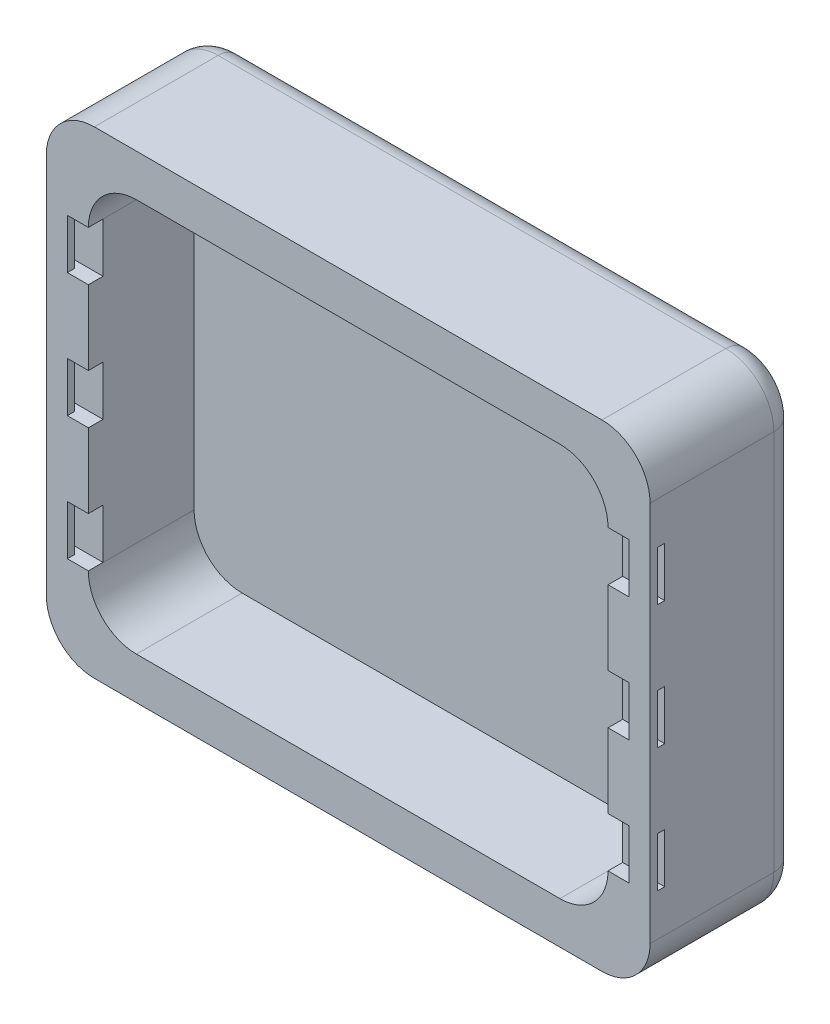
from build123d import *

# Parameters (mm, degrees)
BOSS_EXTRUDE1_DEPTH = 4.4
BOSS_EXTRUDE2_DEPTH = 1.75
VARFILLET1_R        = 1
SKETCH3_W           = 0.875
SKETCH3_H           = 2.065
CUT_EXTRUDE1_DEPTH  = 0.61
SKETCH4_W           = 0.305
SKETCH4_H           = 2.065
CUT_EXTRUDE2_DEPTH  = 0.875
SKETCH5_W           = 0.089743589
SKETCH5_H           = 0.73076923
SKETCH5_W_2         = 0.384615385
SKETCH5_H_2         = 0.102564102
CUT_EXTRUDE3_DEPTH  = 0.1


with BuildPart() as part:
    # Sketch1 → Boss-Extrude1 (new body)
    with BuildSketch(Plane.XY):
        with BuildLine():
            Line((-10.565, 9.94), (10.565, 9.94))
            ThreePointArc((10.565, 9.94), (11.979213562, 9.354213562), (12.565, 7.94))
            Line((12.565, 7.94), (12.565, -7.94))
            ThreePointArc((12.565, -7.94), (11.979213562, -9.354213562), (10.565, -9.94))
            Line((10.565, -9.94), (-10.565, -9.94))
            ThreePointArc((-10.565, -9.94), (-11.979213562, -9.354213562), (-12.565, -7.94))
            Line((-12.565, -7.94), (-12.565, 7.94))
            ThreePointArc((-12.565, 7.94), (-11.979213562, 9.354213562), (-10.565, 9.94))
        make_face()
        with BuildLine():
            Line((-8.815, 8.19), (8.815, 8.19))
            ThreePointArc((8.815, 8.19), (10.229213562, 7.604213562), (10.815, 6.19))
            Line((10.815, 6.19), (10.815, -6.19))
            ThreePointArc((10.815, -6.19), (10.229213562, -7.604213562), (8.815, -8.19))
            Line((8.815, -8.19), (-8.815, -8.19))
            ThreePointArc((-8.815, -8.19), (-10.229213562, -7.604213562), (-10.815, -6.19))
            Line((-10.815, -6.19), (-10.815, 6.19))
            ThreePointArc((-10.815, 6.19), (-10.229213562, 7.604213562), (-8.815, 8.19))
        make_face(mode=Mode.SUBTRACT)
    extrude(amount=-BOSS_EXTRUDE1_DEPTH)

    # Sketch2 → Boss-Extrude2 (add)
    with BuildSketch(Plane(origin=(0, 0, -4.4), x_dir=(-1, 0, 0), z_dir=(0, 0, -1))):
        with BuildLine():
            Line((-10.565, 9.94), (10.565, 9.94))
            ThreePointArc((10.565, 9.94), (11.979213562, 9.354213562), (12.565, 7.94))
            Line((12.565, 7.94), (12.565, -7.94))
            ThreePointArc((12.565, -7.94), (11.979213562, -9.354213562), (10.565, -9.94))
            Line((10.565, -9.94), (-10.565, -9.94))
            ThreePointArc((-10.565, -9.94), (-11.979213562, -9.354213562), (-12.565, -7.94))
            Line((-12.565, -7.94), (-12.565, 7.94))
            ThreePointArc((-12.565, 7.94), (-11.979213562, 9.354213562), (-10.565, 9.94))
        make_face()
    extrude(amount=BOSS_EXTRUDE2_DEPTH)

    # VarFillet1
    varfillet1_edges = [part.edges().sort_by_distance(p)[0] for p in [
        (-11.979213562, 9.354213562, -6.15),
        (0, 9.94, -6.15),
        (11.979213562, 9.354213562, -6.15),
        (12.565, 0, -6.15),
        (11.979213562, -9.354213562, -6.15),
        (0, -9.94, -6.15),
        (-11.979213562, -9.354213562, -6.15),
        (-12.565, 0, -6.15),
    ]]
    fillet(varfillet1_edges, radius=VARFILLET1_R)

    # Sketch3 → Cut-Extrude1 (cut)
    with BuildSketch(Plane.XY):
        with Locations((-11.2525, 5.1575)):
            Rectangle(SKETCH3_W, SKETCH3_H)
        with Locations((-11.2525, 0)):
            Rectangle(SKETCH3_W, SKETCH3_H)
        with Locations((-11.2525, -5.1575)):
            Rectangle(SKETCH3_W, SKETCH3_H)
    cut_extrude1 = extrude(amount=-CUT_EXTRUDE1_DEPTH, mode=Mode.SUBTRACT)

    # Sketch4 → Cut-Extrude2 (cut)
    with BuildSketch(Plane(origin=(-11.69, 0, 0), x_dir=(0, 0, -1), z_dir=(1, 0, 0))):
        with Locations((0.4575, -5.1575)):
            Rectangle(SKETCH4_W, SKETCH4_H)
        with Locations((0.4575, 0)):
            Rectangle(SKETCH4_W, SKETCH4_H)
        with Locations((0.4575, 5.1575)):
            Rectangle(SKETCH4_W, SKETCH4_H)
    cut_extrude2 = extrude(amount=-CUT_EXTRUDE2_DEPTH, mode=Mode.SUBTRACT)

    # Mirror1: Cut-Extrude1, Cut-Extrude2 across plane
    add(cut_extrude1.mirror(Plane(origin=(0, 0, 0), x_dir=(0, 0, 1), z_dir=(1, 0, 0))), mode=Mode.SUBTRACT)
    add(cut_extrude2.mirror(Plane(origin=(0, 0, 0), x_dir=(0, 0, 1), z_dir=(1, 0, 0))), mode=Mode.SUBTRACT)

    # Sketch5 → Cut-Extrude3 (cut)
    # profile 1 of 26: a face of its own
    with BuildSketch(Plane(origin=(0, 0, -6.15), x_dir=(-1, 0, 0), z_dir=(0, 0, -1))):
        Polygon((-10.396455381, 8.135190539), (-10.306711791, 8.135190539), (-10.306711791, 7.237754641), (-9.922096406, 7.237754641), (-9.922096406, 7.135190539), (-10.396455381, 7.135190539), align=None)
    # profile 2 of 26: a face of its own
    with BuildSketch(Plane(origin=(0, 0, -6.15), x_dir=(-1, 0, 0), z_dir=(0, 0, -1))):
        with BuildLine():
            add(Edge.make_bspline(
                [(-9.749420124, 8.173652077), (-9.743851177, 8.173393748), (-9.732946109, 8.172887889), (-9.717176603, 8.168556039), (-9.702817457, 8.161213272), (-9.690080962, 8.151361934), (-9.679151852, 8.139776379), (-9.67150022, 8.126273245), (-9.666582393, 8.111685063), (-9.66598852, 8.101509323), (-9.66568615, 8.096328359)],
                knots=[0, 0, 0, 0, 1.055194115, 2.066272739, 3.074728998, 4.095836921, 5.109056067, 6.073838105, 7.019297344, 8, 8, 8, 8], degree=3))
            add(Edge.make_bspline(
                [(-9.66568615, 8.096328359), (-9.665995339, 8.091281887), (-9.666606568, 8.081305608), (-9.671496421, 8.06697033), (-9.679217061, 8.053654821), (-9.690073954, 8.042091761), (-9.702819314, 8.032245869), (-9.71717611, 8.024901658), (-9.732946238, 8.02057019), (-9.743851221, 8.020064279), (-9.749420124, 8.019805923)],
                knots=[0, 0, 0, 0, 0.96129708, 1.900370562, 2.859976407, 3.87933698, 4.906634145, 5.921202961, 6.938410037, 8, 8, 8, 8], degree=3))
            add(Edge.make_bspline(
                [(-9.749420124, 8.019805923), (-9.754925346, 8.020054415), (-9.76564054, 8.020538071), (-9.781173924, 8.024986647), (-9.795410635, 8.032248383), (-9.80817197, 8.042027293), (-9.818809168, 8.053725835), (-9.826551547, 8.066962204), (-9.831430107, 8.081307677), (-9.832042858, 8.091282582), (-9.832352817, 8.096328359)],
                knots=[0, 0, 0, 0, 1.054934014, 2.053291228, 3.073705704, 4.106921865, 5.123545215, 6.088680038, 7.033164197, 8, 8, 8, 8], degree=3))
            add(Edge.make_bspline(
                [(-9.832352817, 8.096328359), (-9.832049649, 8.101508602), (-9.831454209, 8.111682925), (-9.82654789, 8.126281506), (-9.818873659, 8.139704792), (-9.808164927, 8.151426364), (-9.795412509, 8.161210774), (-9.781173439, 8.168471054), (-9.765640668, 8.172920008), (-9.754925389, 8.173403612), (-9.749420124, 8.173652077)],
                knots=[0, 0, 0, 0, 0.98631895, 1.937192651, 2.907499808, 3.917963147, 4.944918757, 5.95915025, 6.951458133, 8, 8, 8, 8], degree=3))
        make_face()
    # profile 3 of 26: a face of its own
    with BuildSketch(Plane(origin=(0, 0, -6.15), x_dir=(-1, 0, 0), z_dir=(0, 0, -1))):
        with Locations((-9.749019483, 7.500575154)):
            Rectangle(SKETCH5_W, SKETCH5_H)
    # profile 4 of 26: a face of its own
    with BuildSketch(Plane(origin=(0, 0, -6.15), x_dir=(-1, 0, 0), z_dir=(0, 0, -1))):
        with BuildLine():
            Line((-8.768250253, 7.707506244), (-8.843370445, 7.660831564))
            add(Edge.make_bspline(
                [(-8.843370445, 7.660831564), (-8.851607549, 7.671068248), (-8.867820891, 7.691217422), (-8.895974958, 7.717220261), (-8.92597822, 7.739553701), (-8.958343376, 7.757754773), (-8.993025033, 7.771818044), (-9.029886419, 7.781769532), (-9.068922278, 7.787970744), (-9.095683763, 7.788675554), (-9.109396086, 7.789036692)],
                knots=[0, 0, 0, 0, 1.026593902, 2.0206758, 2.988051866, 3.946915611, 4.916868779, 5.907761954, 6.927957743, 8, 8, 8, 8], degree=3))
            add(Edge.make_bspline(
                [(-9.109396086, 7.789036692), (-9.120355788, 7.788734737), (-9.141940623, 7.788140045), (-9.173628095, 7.784422762), (-9.203811625, 7.777667902), (-9.232680399, 7.768767629), (-9.26002909, 7.756838975), (-9.285929352, 7.742321901), (-9.310610921, 7.725450461), (-9.333358561, 7.705904591), (-9.354166849, 7.684647829), (-9.37219511, 7.661861059), (-9.387891377, 7.638226804), (-9.400207364, 7.613154878), (-9.410285984, 7.587218863), (-9.416916476, 7.55992919), (-9.42133496, 7.531635473), (-9.421840483, 7.512344519), (-9.422096406, 7.502578359)],
                knots=[0, 0, 0, 0, 1.112346261, 2.190735716, 3.231507886, 4.247384806, 5.251966152, 6.253067467, 7.256802811, 8.280671706, 9.291813951, 10.270744147, 11.225547591, 12.165006084, 13.100104208, 14.043489273, 15.009504848, 16, 16, 16, 16], degree=3))
            add(Edge.make_bspline(
                [(-9.422096406, 7.502578359), (-9.421588049, 7.489787156), (-9.420578183, 7.4643771), (-9.41266348, 7.426869071), (-9.399707935, 7.390605159), (-9.381977121, 7.355842834), (-9.359555082, 7.323673076), (-9.333220064, 7.29482066), (-9.302957469, 7.269844652), (-9.269033946, 7.249138216), (-9.232246019, 7.232492111), (-9.192991704, 7.220632873), (-9.151591766, 7.213475053), (-9.123246981, 7.212573355), (-9.108795124, 7.212113615)],
                knots=[0, 0, 0, 0, 0.966302908, 1.919585723, 2.883856336, 3.870342332, 4.860282998, 5.839159637, 6.814385684, 7.815993281, 8.834850808, 9.858348828, 10.908058873, 12, 12, 12, 12], degree=3))
            add(Edge.make_bspline(
                [(-9.108795124, 7.212113615), (-9.095550786, 7.2124849), (-9.069522146, 7.213214574), (-9.031474351, 7.219365706), (-8.995251519, 7.229435316), (-8.960854939, 7.243477501), (-8.928347463, 7.26162822), (-8.897939127, 7.284016555), (-8.869024859, 7.309998441), (-8.852025723, 7.33008929), (-8.843370445, 7.340318744)],
                knots=[0, 0, 0, 0, 1.039848629, 2.043578496, 3.018386758, 3.987534228, 4.954977003, 5.934852016, 6.948509513, 8, 8, 8, 8], degree=3))
            Line((-8.843370445, 7.340318744), (-8.768250253, 7.291039898))
            add(Edge.make_bspline(
                [(-8.768250253, 7.291039898), (-8.772703882, 7.28449969), (-8.781596358, 7.271440982), (-8.796461394, 7.253028377), (-8.812495632, 7.235793611), (-8.829636516, 7.219759785), (-8.847660233, 7.204543208), (-8.867182493, 7.19087133), (-8.887573811, 7.177975666), (-8.90907357, 7.166371989), (-8.931459484, 7.155941611), (-8.954700052, 7.146972705), (-8.978694285, 7.139266961), (-9.003470392, 7.133142004), (-9.02907722, 7.128253193), (-9.055448544, 7.125009279), (-9.082575282, 7.12258777), (-9.100910182, 7.122443236), (-9.110197368, 7.122370026)],
                knots=[0, 0, 0, 0, 0.954134338, 1.905101784, 2.851144739, 3.791306361, 4.734911809, 5.6936923, 6.663572882, 7.643865596, 8.638447847, 9.640600242, 10.646758161, 11.676244097, 12.717260333, 13.78922464, 14.880174919, 16, 16, 16, 16], degree=3))
            add(Edge.make_bspline(
                [(-9.110197368, 7.122370026), (-9.124371906, 7.122624677), (-9.152154104, 7.123123796), (-9.192817678, 7.128611931), (-9.231678725, 7.136885536), (-9.26872397, 7.148760889), (-9.30395918, 7.164047967), (-9.3373515, 7.182721371), (-9.368790362, 7.204936169), (-9.397964871, 7.23029696), (-9.42475957, 7.257794286), (-9.447767053, 7.287465691), (-9.467722845, 7.318220276), (-9.483747857, 7.350737283), (-9.496504122, 7.384584533), (-9.505219788, 7.420033173), (-9.510856856, 7.45679096), (-9.51150925, 7.481857497), (-9.511839996, 7.494565539)],
                knots=[0, 0, 0, 0, 1.1129367, 2.181364009, 3.217532258, 4.231199276, 5.232079859, 6.230262199, 7.231623845, 8.250719726, 9.263571943, 10.242672461, 11.195837495, 12.138959767, 13.085126421, 14.0317438, 15.002148558, 16, 16, 16, 16], degree=3))
            add(Edge.make_bspline(
                [(-9.511839996, 7.494565539), (-9.511713992, 7.503187948), (-9.511463348, 7.520339345), (-9.508588511, 7.545795078), (-9.504874662, 7.570911805), (-9.498581594, 7.595371154), (-9.491312842, 7.619544094), (-9.482034119, 7.643139266), (-9.47114972, 7.666266315), (-9.458792021, 7.688865666), (-9.444880951, 7.710565535), (-9.429486313, 7.731066582), (-9.413187931, 7.750615086), (-9.395223328, 7.768536161), (-9.376354855, 7.785546501), (-9.356048691, 7.801191679), (-9.334421304, 7.815517677), (-9.311797498, 7.828789395), (-9.288190438, 7.840606377), (-9.263742818, 7.850787302), (-9.238601952, 7.859488038), (-9.212727625, 7.866376301), (-9.186291576, 7.872152707), (-9.159085479, 7.875786378), (-9.131213416, 7.878353884), (-9.112340266, 7.878636968), (-9.102785509, 7.878780282)],
                knots=[0, 0, 0, 0, 0.990994727, 1.971252077, 2.943264845, 3.907940874, 4.872158414, 5.844625996, 6.82015047, 7.809835459, 8.804511986, 9.781214284, 10.756496977, 11.728388426, 12.696359165, 13.676225489, 14.672885716, 15.677705647, 16.690706858, 17.706033469, 18.721040654, 19.747369689, 20.783475414, 21.830280724, 22.901553713, 24, 24, 24, 24], degree=3))
            add(Edge.make_bspline(
                [(-9.102785509, 7.878780282), (-9.090819764, 7.878516885), (-9.066948084, 7.877991406), (-9.031536454, 7.873568934), (-8.996646398, 7.866901387), (-8.962890083, 7.857023435), (-8.930676793, 7.845062391), (-8.900523807, 7.831630187), (-8.87314092, 7.816031729), (-8.848018752, 7.798968839), (-8.825110319, 7.779722866), (-8.804180464, 7.758063735), (-8.784799992, 7.73410417), (-8.77381236, 7.716445389), (-8.768250253, 7.707506244)],
                knots=[0, 0, 0, 0, 1.095225653, 2.184976855, 3.262915854, 4.344593502, 5.400796181, 6.407717688, 7.363229445, 8.282371371, 9.184954523, 10.097238608, 11.036792983, 12, 12, 12, 12], degree=3))
        make_face()
    # profile 5 of 26: a face of its own
    with BuildSketch(Plane(origin=(0, 0, -6.15), x_dir=(-1, 0, 0), z_dir=(0, 0, -1))):
        with BuildLine():
            Line((-7.989003458, 7.365959769), (-7.909275894, 7.324092782))
            add(Edge.make_bspline(
                [(-7.909275894, 7.324092782), (-7.915629207, 7.312823259), (-7.927990238, 7.29089723), (-7.949247594, 7.260773841), (-7.971531043, 7.233674493), (-7.995846463, 7.210323164), (-8.021466371, 7.189965625), (-8.048532844, 7.172154818), (-8.077186792, 7.156978098), (-8.10742957, 7.144191661), (-8.139515156, 7.134360377), (-8.173521304, 7.127416314), (-8.20951316, 7.123123952), (-8.234183497, 7.12262534), (-8.246815958, 7.122370026)],
                knots=[0, 0, 0, 0, 1.120438281, 2.179929193, 3.190490725, 4.156257408, 5.095198341, 6.022838206, 6.959905092, 7.901321166, 8.864066838, 9.862729781, 10.905609505, 12, 12, 12, 12], degree=3))
            add(Edge.make_bspline(
                [(-8.246815958, 7.122370026), (-8.260856523, 7.12269779), (-8.288245598, 7.123337163), (-8.328114097, 7.128849296), (-8.365651073, 7.137841399), (-8.400854417, 7.150402982), (-8.433637918, 7.166810789), (-8.464066734, 7.186799212), (-8.492300884, 7.210265571), (-8.517450658, 7.237413126), (-8.540091767, 7.266465114), (-8.560070573, 7.296738224), (-8.576772696, 7.328156288), (-8.590359156, 7.360519295), (-8.601331975, 7.393623264), (-8.608979604, 7.427769398), (-8.613388104, 7.462865279), (-8.61406366, 7.486607375), (-8.614404099, 7.498571949)],
                knots=[0, 0, 0, 0, 1.145258523, 2.234067595, 3.276747158, 4.290159414, 5.277019952, 6.260822364, 7.254936242, 8.264827045, 9.274100331, 10.257902744, 11.220704747, 12.172965371, 13.118907548, 14.062713208, 15.023725156, 16, 16, 16, 16], degree=3))
            add(Edge.make_bspline(
                [(-8.614404099, 7.498571949), (-8.614101487, 7.509799043), (-8.61350175, 7.532049662), (-8.609721525, 7.564982674), (-8.603022013, 7.596990804), (-8.593828778, 7.628100646), (-8.581956993, 7.658260113), (-8.567433502, 7.68748756), (-8.55023568, 7.715751885), (-8.536957773, 7.733581352), (-8.530269483, 7.742562333)],
                knots=[0, 0, 0, 0, 1.024358464, 2.0301432, 3.019427413, 4.004406732, 4.986367066, 5.972626655, 6.978780325, 8, 8, 8, 8], degree=3))
            add(Edge.make_bspline(
                [(-8.530269483, 7.742562333), (-8.521210145, 7.753382011), (-8.503378446, 7.774678625), (-8.473219488, 7.802661004), (-8.440562289, 7.826102082), (-8.40581611, 7.845532693), (-8.368577117, 7.860296592), (-8.329345891, 7.871298758), (-8.287675724, 7.877463904), (-8.259188518, 7.878334714), (-8.244612432, 7.878780282)],
                knots=[0, 0, 0, 0, 1.030682036, 2.02871468, 2.997146059, 3.962720338, 4.930598197, 5.918074684, 6.934738563, 8, 8, 8, 8], degree=3))
            add(Edge.make_bspline(
                [(-8.244612432, 7.878780282), (-8.229627402, 7.878393411), (-8.200230189, 7.877634458), (-8.157363869, 7.870598363), (-8.116803664, 7.85944049), (-8.078565806, 7.843682264), (-8.042646417, 7.823350964), (-8.009278974, 7.79816758), (-7.977892828, 7.76890527), (-7.959633234, 7.746401496), (-7.950341599, 7.734950154)],
                knots=[0, 0, 0, 0, 1.056321875, 2.072262726, 3.055038591, 4.01806755, 4.982017516, 5.957941055, 6.960871419, 8, 8, 8, 8], degree=3))
            add(Edge.make_bspline(
                [(-7.950341599, 7.734950154), (-7.944019616, 7.726320559), (-7.931417733, 7.709118811), (-7.915632847, 7.681069909), (-7.901930734, 7.651724025), (-7.89097846, 7.620606797), (-7.882110031, 7.588086917), (-7.875693797, 7.553931904), (-7.871931049, 7.51815193), (-7.871191421, 7.493772914), (-7.870814355, 7.481344385)],
                knots=[0, 0, 0, 0, 0.94817472, 1.890038105, 2.849395472, 3.817997239, 4.812318967, 5.836947057, 6.897266129, 8, 8, 8, 8], degree=3))
            Line((-7.870814355, 7.481344385), (-8.524660509, 7.481344385))
            add(Edge.make_bspline(
                [(-8.524660509, 7.481344385), (-8.524220621, 7.471715681), (-8.5233556, 7.452781222), (-8.519322702, 7.425075284), (-8.51296591, 7.398682901), (-8.504031892, 7.373802032), (-8.493212793, 7.35010771), (-8.479959731, 7.327775699), (-8.46414843, 7.306907719), (-8.446512516, 7.287317108), (-8.426881917, 7.269871177), (-8.406229704, 7.254256383), (-8.384260114, 7.24116907), (-8.361146376, 7.230546244), (-8.336925866, 7.222230154), (-8.311590953, 7.216553634), (-8.285191491, 7.212751603), (-8.267195567, 7.212328842), (-8.258033906, 7.212113615)],
                knots=[0, 0, 0, 0, 1.094153842, 2.151609401, 3.174256925, 4.172055639, 5.149267565, 6.128595816, 7.11444997, 8.118368179, 9.117203808, 10.09244225, 11.054858984, 12.015122123, 12.976791628, 13.957293641, 14.960065497, 16, 16, 16, 16], degree=3))
            add(Edge.make_bspline(
                [(-8.258033906, 7.212113615), (-8.249076436, 7.212287346), (-8.231303095, 7.212632061), (-8.204834279, 7.215984035), (-8.178794414, 7.221404114), (-8.153291276, 7.228801254), (-8.128842463, 7.237823212), (-8.106200877, 7.248709742), (-8.085377958, 7.260752527), (-8.065915968, 7.27452672), (-8.047038541, 7.291386202), (-8.028312117, 7.312424979), (-8.008233073, 7.33730713), (-7.995664618, 7.356034463), (-7.989003458, 7.365959769)],
                knots=[0, 0, 0, 0, 0.99110716, 1.966546729, 2.947904876, 3.932708344, 4.903319531, 5.828989031, 6.710028674, 7.56322171, 8.463672341, 9.504779593, 10.677557249, 12, 12, 12, 12], degree=3))
        make_face()
        with BuildLine():
            add(Edge.make_bspline(
                [(-7.960557945, 7.571087974), (-7.963842695, 7.582991653), (-7.970164781, 7.605902401), (-7.983375171, 7.63762837), (-7.998252754, 7.665824913), (-8.015858963, 7.690276237), (-8.03580717, 7.711991526), (-8.058848651, 7.730968265), (-8.084687478, 7.74794468), (-8.113190089, 7.762273965), (-8.143373456, 7.774471068), (-8.174975226, 7.782649672), (-8.207220308, 7.788252399), (-8.229030104, 7.788774144), (-8.24000506, 7.789036692)],
                knots=[0, 0, 0, 0, 1.154881502, 2.222775134, 3.210006277, 4.132804581, 5.035138423, 5.962687519, 6.919655026, 7.923214229, 8.944639381, 9.960483929, 10.97369054, 12, 12, 12, 12], degree=3))
            add(Edge.make_bspline(
                [(-8.24000506, 7.789036692), (-8.248962043, 7.788861929), (-8.266668114, 7.788516459), (-8.292754133, 7.785239279), (-8.317805476, 7.77982218), (-8.342006987, 7.772403621), (-8.365041521, 7.762515449), (-8.387382883, 7.750920242), (-8.408462996, 7.736765503), (-8.421646223, 7.725977259), (-8.428306342, 7.720527077)],
                knots=[0, 0, 0, 0, 1.04873581, 2.073130211, 3.073294108, 4.04793562, 5.032784715, 6.005352987, 6.992311501, 8, 8, 8, 8], degree=3))
            add(Edge.make_bspline(
                [(-8.428306342, 7.720527077), (-8.433075852, 7.716214415), (-8.442728176, 7.707486639), (-8.455625467, 7.692449723), (-8.467974174, 7.676234991), (-8.47921236, 7.658222098), (-8.489520242, 7.638616162), (-8.49916595, 7.617582552), (-8.507847782, 7.594961657), (-8.512732385, 7.579198103), (-8.515245445, 7.571087974)],
                knots=[0, 0, 0, 0, 0.879870761, 1.780643979, 2.707998968, 3.669668524, 4.684282772, 5.740141944, 6.837334558, 8, 8, 8, 8], degree=3))
            Line((-8.515245445, 7.571087974), (-7.960557945, 7.571087974))
        make_face(mode=Mode.SUBTRACT)
    # profile 6 of 26: a face of its own
    with BuildSketch(Plane(origin=(0, 0, -6.15), x_dir=(-1, 0, 0), z_dir=(0, 0, -1))):
        with BuildLine():
            Line((-7.691327176, 7.865959769), (-7.601583586, 7.865959769))
            Line((-7.601583586, 7.865959769), (-7.601583586, 7.734148872))
            add(Edge.make_bspline(
                [(-7.601583586, 7.734148872), (-7.592001405, 7.746103936), (-7.573406847, 7.769303154), (-7.542439895, 7.799794746), (-7.509713066, 7.824921954), (-7.475426779, 7.844951609), (-7.439534491, 7.860050645), (-7.402254985, 7.870955197), (-7.363365069, 7.877493719), (-7.336918087, 7.878348071), (-7.323538714, 7.878780282)],
                knots=[0, 0, 0, 0, 1.12780773, 2.188550248, 3.19190651, 4.159438251, 5.104880172, 6.052711206, 7.014878035, 8, 8, 8, 8], degree=3))
            add(Edge.make_bspline(
                [(-7.323538714, 7.878780282), (-7.310015676, 7.878281655), (-7.283547828, 7.877305721), (-7.245011239, 7.869586666), (-7.209018841, 7.856402308), (-7.175698968, 7.838341716), (-7.145662621, 7.815882724), (-7.119284092, 7.789717643), (-7.097466021, 7.75962162), (-7.082838203, 7.731700718), (-7.073202304, 7.706932491), (-7.067135922, 7.685719134), (-7.061984213, 7.662085376), (-7.057517999, 7.636102636), (-7.054495967, 7.607588868), (-7.052112455, 7.576660956), (-7.050404257, 7.543328919), (-7.050336484, 7.520275596), (-7.050301535, 7.508387654)],
                knots=[0, 0, 0, 0, 1.235846778, 2.418850247, 3.575807741, 4.728682307, 5.871620074, 6.994088408, 8.11269785, 9.256955736, 9.865816715, 10.540099792, 11.271859618, 12.076849838, 12.949306005, 13.892391288, 14.913166135, 16, 16, 16, 16], degree=3))
            Line((-7.050301535, 7.508387654), (-7.050301535, 7.135190539))
            Line((-7.050301535, 7.135190539), (-7.140045124, 7.135190539))
            Line((-7.140045124, 7.135190539), (-7.140045124, 7.478940539))
            add(Edge.make_bspline(
                [(-7.140045124, 7.478940539), (-7.140100327, 7.488889809), (-7.140205919, 7.507921069), (-7.140538961, 7.535169361), (-7.141341763, 7.559879812), (-7.142469853, 7.581993346), (-7.144121004, 7.601488727), (-7.145841756, 7.618405664), (-7.147946035, 7.632722676), (-7.149821153, 7.641341271), (-7.150662112, 7.645206564)],
                knots=[0, 0, 0, 0, 1.430800155, 2.736877192, 3.918605307, 4.986035426, 5.920637409, 6.731861385, 7.431261377, 8, 8, 8, 8], degree=3))
            add(Edge.make_bspline(
                [(-7.150662112, 7.645206564), (-7.153697978, 7.656552617), (-7.159541081, 7.678390258), (-7.173979362, 7.708011502), (-7.192211985, 7.733210984), (-7.214468513, 7.753832905), (-7.240533963, 7.769881715), (-7.270336004, 7.781017131), (-7.303587044, 7.787981779), (-7.326974011, 7.788675245), (-7.339163714, 7.789036692)],
                knots=[0, 0, 0, 0, 1.084156227, 2.086665306, 3.027808233, 3.945421172, 4.874247719, 5.839848303, 6.874090471, 8, 8, 8, 8], degree=3))
            add(Edge.make_bspline(
                [(-7.339163714, 7.789036692), (-7.346383052, 7.788900691), (-7.360669936, 7.788631548), (-7.381855642, 7.785931177), (-7.402405406, 7.781514475), (-7.422525466, 7.775552008), (-7.441813407, 7.767362788), (-7.460888919, 7.758068682), (-7.479033708, 7.746483479), (-7.496634679, 7.733571872), (-7.513009767, 7.719263528), (-7.528246435, 7.704165096), (-7.541828727, 7.688086352), (-7.554134062, 7.671286367), (-7.564756423, 7.653534413), (-7.574028734, 7.635001754), (-7.581896076, 7.615663998), (-7.585805416, 7.602242552), (-7.587761471, 7.595527077)],
                knots=[0, 0, 0, 0, 1.023777757, 2.026029729, 3.023749952, 4.003683103, 4.997618607, 5.993177895, 7.010360494, 8.046726602, 9.087585522, 10.09234134, 11.086953743, 12.070360549, 13.043493632, 14.017870808, 15.008233677, 16, 16, 16, 16], degree=3))
            add(Edge.make_bspline(
                [(-7.587761471, 7.595527077), (-7.588887084, 7.590597019), (-7.591337487, 7.579864541), (-7.59398411, 7.562251849), (-7.596386274, 7.541877571), (-7.598396834, 7.51876548), (-7.599626953, 7.492834659), (-7.600968209, 7.464195848), (-7.601456512, 7.432734851), (-7.601540042, 7.41083151), (-7.601583586, 7.399413295)],
                knots=[0, 0, 0, 0, 0.615963638, 1.340920617, 2.168419149, 3.115676021, 4.16674242, 5.331190069, 6.6087489, 8, 8, 8, 8], degree=3))
            Line((-7.601583586, 7.399413295), (-7.601583586, 7.135190539))
            Line((-7.601583586, 7.135190539), (-7.691327176, 7.135190539))
            Line((-7.691327176, 7.135190539), (-7.691327176, 7.865959769))
        make_face()
    # profile 7 of 26: a face of its own
    with BuildSketch(Plane(origin=(0, 0, -6.15), x_dir=(-1, 0, 0), z_dir=(0, 0, -1))):
        with BuildLine():
            Line((-6.499019483, 7.774813936), (-6.559916919, 7.712113615))
            add(Edge.make_bspline(
                [(-6.559916919, 7.712113615), (-6.565171349, 7.718203086), (-6.575301271, 7.729942868), (-6.591367408, 7.745639173), (-6.607374152, 7.758821155), (-6.623102384, 7.769950372), (-6.638947604, 7.778364414), (-6.654723866, 7.784505803), (-6.670447506, 7.788306319), (-6.680957802, 7.788796158), (-6.686118842, 7.789036692)],
                knots=[0, 0, 0, 0, 1.26578478, 2.440284043, 3.530471711, 4.527705817, 5.468200915, 6.346673037, 7.188140097, 8, 8, 8, 8], degree=3))
            add(Edge.make_bspline(
                [(-6.686118842, 7.789036692), (-6.692444382, 7.788729586), (-6.70489215, 7.788125244), (-6.722728098, 7.782092835), (-6.739285419, 7.772833195), (-6.753615985, 7.759699314), (-6.765755322, 7.744623809), (-6.774616374, 7.727767716), (-6.780035226, 7.709639704), (-6.780722293, 7.697059744), (-6.781070765, 7.690679321)],
                knots=[0, 0, 0, 0, 0.99966794, 1.967205029, 2.953328237, 3.988086729, 5.028030931, 6.008226631, 6.989793394, 8, 8, 8, 8], degree=3))
            add(Edge.make_bspline(
                [(-6.781070765, 7.690679321), (-6.780753391, 7.684904451), (-6.780119535, 7.673370991), (-6.775191913, 7.656357267), (-6.767344464, 7.639769541), (-6.760010122, 7.629608711), (-6.756231022, 7.624373231)],
                knots=[0, 0, 0, 0, 0.960159726, 1.917612774, 2.927026955, 4, 4, 4, 4], degree=3))
            add(Edge.make_bspline(
                [(-6.756231022, 7.624373231), (-6.753955738, 7.621577635), (-6.749113083, 7.615627563), (-6.740024936, 7.607369319), (-6.729732792, 7.598242961), (-6.717355667, 7.589118151), (-6.703426802, 7.579509086), (-6.687644149, 7.569794191), (-6.670508576, 7.559232927), (-6.658240774, 7.552534517), (-6.651864035, 7.549052718)],
                knots=[0, 0, 0, 0, 0.66740084, 1.420478572, 2.27185888, 3.217733974, 4.268547843, 5.408967954, 6.65319498, 8, 8, 8, 8], degree=3))
            add(Edge.make_bspline(
                [(-6.651864035, 7.549052718), (-6.644088727, 7.544697032), (-6.629069393, 7.536283279), (-6.607728602, 7.523223364), (-6.588360876, 7.510242957), (-6.570802114, 7.497480879), (-6.555390168, 7.48458006), (-6.541657439, 7.472034986), (-6.529946455, 7.459466612), (-6.52338819, 7.450685723), (-6.520253458, 7.446488615)],
                knots=[0, 0, 0, 0, 1.27191281, 2.456916733, 3.569705269, 4.599008579, 5.553216877, 6.436649441, 7.252746552, 8, 8, 8, 8], degree=3))
            add(Edge.make_bspline(
                [(-6.520253458, 7.446488615), (-6.51505045, 7.43801259), (-6.504695499, 7.421143727), (-6.493821708, 7.393367034), (-6.487518773, 7.36390689), (-6.486643853, 7.343754827), (-6.486198971, 7.333507846)],
                knots=[0, 0, 0, 0, 0.995354457, 1.980940102, 2.973342416, 4, 4, 4, 4], degree=3))
            add(Edge.make_bspline(
                [(-6.486198971, 7.333507846), (-6.486404552, 7.32628809), (-6.486809672, 7.312060772), (-6.489626262, 7.291107964), (-6.494470541, 7.271069519), (-6.501068757, 7.251728009), (-6.509978577, 7.233454026), (-6.520420805, 7.215786526), (-6.532956494, 7.199107689), (-6.547268316, 7.183439415), (-6.562938457, 7.169129201), (-6.579654497, 7.156550928), (-6.59743702, 7.146101118), (-6.616158963, 7.137453876), (-6.635862864, 7.130577231), (-6.656551804, 7.125816508), (-6.678160019, 7.122967148), (-6.69285425, 7.122571583), (-6.700341599, 7.122370026)],
                knots=[0, 0, 0, 0, 1.032770009, 2.035186124, 3.017557409, 3.978232242, 4.952395191, 5.920591857, 6.910227898, 7.931268572, 8.952309245, 9.941945286, 10.918353717, 11.897095711, 12.887975737, 13.898235213, 14.929059601, 16, 16, 16, 16], degree=3))
            add(Edge.make_bspline(
                [(-6.700341599, 7.122370026), (-6.710446506, 7.122653654), (-6.730515914, 7.123216971), (-6.760198691, 7.128504417), (-6.789204622, 7.136731672), (-6.817314205, 7.148079082), (-6.843898809, 7.162407857), (-6.86822193, 7.179568541), (-6.890368062, 7.198994254), (-6.902973283, 7.213883658), (-6.909275894, 7.221328359)],
                knots=[0, 0, 0, 0, 1.013940152, 2.01379169, 3.017749504, 4.037548394, 5.051665909, 6.043208538, 7.021604269, 8, 8, 8, 8], degree=3))
            Line((-6.909275894, 7.221328359), (-6.849780701, 7.289036692))
            add(Edge.make_bspline(
                [(-6.849780701, 7.289036692), (-6.844131441, 7.282935331), (-6.833179494, 7.27110692), (-6.815664861, 7.255357108), (-6.797842175, 7.242156745), (-6.779889407, 7.231115769), (-6.761540809, 7.222608511), (-6.742899205, 7.21663177), (-6.724002512, 7.212790572), (-6.711310473, 7.212339634), (-6.704948971, 7.212113615)],
                knots=[0, 0, 0, 0, 1.179806542, 2.287233372, 3.337373186, 4.324005949, 5.273901747, 6.200048787, 7.097828587, 8, 8, 8, 8], degree=3))
            add(Edge.make_bspline(
                [(-6.704948971, 7.212113615), (-6.696286706, 7.21250528), (-6.679362094, 7.213270526), (-6.65512102, 7.220218267), (-6.632738556, 7.231112538), (-6.613303314, 7.246565309), (-6.596759839, 7.264552616), (-6.584780361, 7.284813793), (-6.577272882, 7.306754209), (-6.576391168, 7.321963438), (-6.57594256, 7.329701756)],
                knots=[0, 0, 0, 0, 1.072336372, 2.095165389, 3.102688358, 4.141489647, 5.156069229, 6.117746104, 7.042326257, 8, 8, 8, 8], degree=3))
            add(Edge.make_bspline(
                [(-6.57594256, 7.329701756), (-6.57625293, 7.336075933), (-6.576865714, 7.348660892), (-6.581678077, 7.366875275), (-6.589281749, 7.384152212), (-6.596768792, 7.39426354), (-6.600581983, 7.399413295)],
                knots=[0, 0, 0, 0, 1.013901739, 2.00181326, 2.98231254, 4, 4, 4, 4], degree=3))
            add(Edge.make_bspline(
                [(-6.600581983, 7.399413295), (-6.602874096, 7.401994827), (-6.607867145, 7.407618336), (-6.617025786, 7.415739787), (-6.627992032, 7.42449353), (-6.640889221, 7.433731127), (-6.655743353, 7.443330728), (-6.672614632, 7.453241972), (-6.691271933, 7.463935608), (-6.704463542, 7.471026938), (-6.711359227, 7.474733808)],
                knots=[0, 0, 0, 0, 0.615000592, 1.339693406, 2.178160186, 3.116406724, 4.166410947, 5.330106347, 6.604359322, 8, 8, 8, 8], degree=3))
            add(Edge.make_bspline(
                [(-6.711359227, 7.474733808), (-6.718801124, 7.478887845), (-6.733233338, 7.48694385), (-6.753675421, 7.499491302), (-6.772117522, 7.51225338), (-6.7890034, 7.524514191), (-6.803906545, 7.536920175), (-6.816768244, 7.549485104), (-6.828094878, 7.561702243), (-6.834365567, 7.570358614), (-6.83736083, 7.574493423)],
                knots=[0, 0, 0, 0, 1.262093308, 2.447601706, 3.550203992, 4.582594899, 5.537233252, 6.418365656, 7.244515135, 8, 8, 8, 8], degree=3))
            add(Edge.make_bspline(
                [(-6.83736083, 7.574493423), (-6.842541001, 7.582820742), (-6.852903154, 7.599478289), (-6.862964637, 7.627281282), (-6.869880645, 7.656551299), (-6.870498471, 7.676747543), (-6.870814355, 7.687073551)],
                knots=[0, 0, 0, 0, 0.985009483, 1.970363186, 2.962279964, 4, 4, 4, 4], degree=3))
            add(Edge.make_bspline(
                [(-6.870814355, 7.687073551), (-6.870661728, 7.693823665), (-6.870363015, 7.707034594), (-6.867979, 7.726445685), (-6.863638511, 7.744888015), (-6.858194248, 7.762638547), (-6.850627675, 7.779353431), (-6.841585988, 7.795255566), (-6.830961009, 7.810322971), (-6.818720069, 7.824323866), (-6.805261027, 7.837040816), (-6.790719665, 7.848126139), (-6.77542302, 7.857585097), (-6.759306329, 7.865518), (-6.742214765, 7.871518395), (-6.724267797, 7.875649077), (-6.705501753, 7.878407706), (-6.69267286, 7.878654302), (-6.686118842, 7.878780282)],
                knots=[0, 0, 0, 0, 1.087655834, 2.128696564, 3.144119009, 4.137814668, 5.115653402, 6.093965665, 7.082169637, 8.081268856, 9.086088321, 10.061021666, 11.022561449, 11.980240094, 12.950172527, 13.934149372, 14.944599409, 16, 16, 16, 16], degree=3))
            add(Edge.make_bspline(
                [(-6.686118842, 7.878780282), (-6.678349681, 7.878464756), (-6.662665618, 7.877827785), (-6.639135725, 7.872769017), (-6.615640484, 7.864445273), (-6.592119527, 7.852949206), (-6.568745159, 7.838072956), (-6.545311771, 7.820093156), (-6.521538048, 7.799128095), (-6.506693387, 7.783099745), (-6.499019483, 7.774813936)],
                knots=[0, 0, 0, 0, 0.845714091, 1.707292901, 2.609013841, 3.555613372, 4.552488639, 5.621697636, 6.770543573, 8, 8, 8, 8], degree=3))
        make_face()
    # profile 8 of 26: a face of its own
    with BuildSketch(Plane(origin=(0, 0, -6.15), x_dir=(-1, 0, 0), z_dir=(0, 0, -1))):
        with BuildLine():
            Line((-5.706952176, 7.365959769), (-5.627224612, 7.324092782))
            add(Edge.make_bspline(
                [(-5.627224612, 7.324092782), (-5.633577925, 7.312823259), (-5.645938956, 7.29089723), (-5.667196312, 7.260773841), (-5.689479761, 7.233674493), (-5.713795181, 7.210323164), (-5.739415089, 7.189965625), (-5.766481562, 7.172154818), (-5.79513551, 7.156978098), (-5.825378288, 7.144191661), (-5.857463874, 7.134360377), (-5.891470022, 7.127416314), (-5.927461878, 7.123123952), (-5.952132215, 7.12262534), (-5.964764676, 7.122370026)],
                knots=[0, 0, 0, 0, 1.120438281, 2.179929193, 3.190490725, 4.156257408, 5.095198341, 6.022838206, 6.959905092, 7.901321166, 8.864066838, 9.862729781, 10.905609505, 12, 12, 12, 12], degree=3))
            add(Edge.make_bspline(
                [(-5.964764676, 7.122370026), (-5.978805241, 7.12269779), (-6.006194315, 7.123337163), (-6.046062815, 7.128849296), (-6.083599791, 7.137841399), (-6.118803135, 7.150402982), (-6.151586636, 7.166810789), (-6.182015452, 7.186799212), (-6.210249602, 7.210265571), (-6.235399376, 7.237413126), (-6.258040485, 7.266465114), (-6.278019291, 7.296738224), (-6.294721414, 7.328156288), (-6.308307874, 7.360519295), (-6.319280693, 7.393623264), (-6.326928322, 7.427769398), (-6.331336822, 7.462865279), (-6.332012378, 7.486607375), (-6.332352817, 7.498571949)],
                knots=[0, 0, 0, 0, 1.145258523, 2.234067595, 3.276747158, 4.290159414, 5.277019952, 6.260822364, 7.254936242, 8.264827045, 9.274100331, 10.257902744, 11.220704747, 12.172965371, 13.118907548, 14.062713208, 15.023725156, 16, 16, 16, 16], degree=3))
            add(Edge.make_bspline(
                [(-6.332352817, 7.498571949), (-6.332050205, 7.509799043), (-6.331450468, 7.532049662), (-6.327670243, 7.564982674), (-6.320970731, 7.596990804), (-6.311777496, 7.628100646), (-6.299905711, 7.658260113), (-6.28538222, 7.68748756), (-6.268184398, 7.715751885), (-6.254906491, 7.733581352), (-6.248218201, 7.742562333)],
                knots=[0, 0, 0, 0, 1.024358464, 2.0301432, 3.019427413, 4.004406732, 4.986367066, 5.972626655, 6.978780325, 8, 8, 8, 8], degree=3))
            add(Edge.make_bspline(
                [(-6.248218201, 7.742562333), (-6.239158863, 7.753382011), (-6.221327164, 7.774678625), (-6.191168206, 7.802661004), (-6.158511007, 7.826102082), (-6.123764828, 7.845532693), (-6.086525835, 7.860296592), (-6.047294609, 7.871298758), (-6.005624442, 7.877463904), (-5.977137236, 7.878334714), (-5.96256115, 7.878780282)],
                knots=[0, 0, 0, 0, 1.030682036, 2.02871468, 2.997146059, 3.962720338, 4.930598197, 5.918074684, 6.934738563, 8, 8, 8, 8], degree=3))
            add(Edge.make_bspline(
                [(-5.96256115, 7.878780282), (-5.94757612, 7.878393411), (-5.918178907, 7.877634458), (-5.875312587, 7.870598363), (-5.834752382, 7.85944049), (-5.796514523, 7.843682264), (-5.760595135, 7.823350964), (-5.727227692, 7.79816758), (-5.695841546, 7.76890527), (-5.677581952, 7.746401496), (-5.668290317, 7.734950154)],
                knots=[0, 0, 0, 0, 1.056321875, 2.072262726, 3.055038591, 4.01806755, 4.982017516, 5.957941055, 6.960871419, 8, 8, 8, 8], degree=3))
            add(Edge.make_bspline(
                [(-5.668290317, 7.734950154), (-5.661968334, 7.726320559), (-5.649366451, 7.709118811), (-5.633581565, 7.681069909), (-5.619879452, 7.651724025), (-5.608927177, 7.620606797), (-5.600058749, 7.588086917), (-5.593642515, 7.553931904), (-5.589879766, 7.51815193), (-5.589140139, 7.493772914), (-5.588763073, 7.481344385)],
                knots=[0, 0, 0, 0, 0.94817472, 1.890038105, 2.849395472, 3.817997239, 4.812318967, 5.836947057, 6.897266129, 8, 8, 8, 8], degree=3))
            Line((-5.588763073, 7.481344385), (-6.242609227, 7.481344385))
            add(Edge.make_bspline(
                [(-6.242609227, 7.481344385), (-6.242169339, 7.471715681), (-6.241304318, 7.452781222), (-6.23727142, 7.425075284), (-6.230914628, 7.398682901), (-6.22198061, 7.373802032), (-6.211161511, 7.35010771), (-6.197908449, 7.327775699), (-6.182097148, 7.306907719), (-6.164461234, 7.287317108), (-6.144830635, 7.269871177), (-6.124178422, 7.254256383), (-6.102208832, 7.24116907), (-6.079095094, 7.230546244), (-6.054874584, 7.222230154), (-6.029539671, 7.216553634), (-6.003140209, 7.212751603), (-5.985144285, 7.212328842), (-5.975982624, 7.212113615)],
                knots=[0, 0, 0, 0, 1.094153842, 2.151609401, 3.174256925, 4.172055639, 5.149267565, 6.128595816, 7.11444997, 8.118368179, 9.117203808, 10.09244225, 11.054858984, 12.015122123, 12.976791628, 13.957293641, 14.960065497, 16, 16, 16, 16], degree=3))
            add(Edge.make_bspline(
                [(-5.975982624, 7.212113615), (-5.967025154, 7.212287346), (-5.949251813, 7.212632061), (-5.922782997, 7.215984035), (-5.896743132, 7.221404114), (-5.871239994, 7.228801254), (-5.846791181, 7.237823212), (-5.824149595, 7.248709742), (-5.803326676, 7.260752527), (-5.783864686, 7.27452672), (-5.764987259, 7.291386202), (-5.746260835, 7.312424979), (-5.726181791, 7.33730713), (-5.713613336, 7.356034463), (-5.706952176, 7.365959769)],
                knots=[0, 0, 0, 0, 0.99110716, 1.966546729, 2.947904876, 3.932708344, 4.903319531, 5.828989031, 6.710028674, 7.56322171, 8.463672341, 9.504779593, 10.677557249, 12, 12, 12, 12], degree=3))
        make_face()
        with BuildLine():
            add(Edge.make_bspline(
                [(-5.678506663, 7.571087974), (-5.681791413, 7.582991653), (-5.688113499, 7.605902401), (-5.701323889, 7.63762837), (-5.716201472, 7.665824913), (-5.733807681, 7.690276237), (-5.753755888, 7.711991526), (-5.776797369, 7.730968265), (-5.802636196, 7.74794468), (-5.831138807, 7.762273965), (-5.861322174, 7.774471068), (-5.892923943, 7.782649672), (-5.925169026, 7.788252399), (-5.946978822, 7.788774144), (-5.957953778, 7.789036692)],
                knots=[0, 0, 0, 0, 1.154881502, 2.222775134, 3.210006277, 4.132804581, 5.035138423, 5.962687519, 6.919655026, 7.923214229, 8.944639381, 9.960483929, 10.97369054, 12, 12, 12, 12], degree=3))
            add(Edge.make_bspline(
                [(-5.957953778, 7.789036692), (-5.966910761, 7.788861929), (-5.984616832, 7.788516459), (-6.010702851, 7.785239279), (-6.035754194, 7.77982218), (-6.059955705, 7.772403621), (-6.082990238, 7.762515449), (-6.105331601, 7.750920242), (-6.126411714, 7.736765503), (-6.139594941, 7.725977259), (-6.14625506, 7.720527077)],
                knots=[0, 0, 0, 0, 1.04873581, 2.073130211, 3.073294108, 4.04793562, 5.032784715, 6.005352987, 6.992311501, 8, 8, 8, 8], degree=3))
            add(Edge.make_bspline(
                [(-6.14625506, 7.720527077), (-6.151024569, 7.716214415), (-6.160676894, 7.707486639), (-6.173574185, 7.692449723), (-6.185922892, 7.676234991), (-6.197161078, 7.658222098), (-6.20746896, 7.638616162), (-6.217114668, 7.617582552), (-6.2257965, 7.594961657), (-6.230681103, 7.579198103), (-6.233194163, 7.571087974)],
                knots=[0, 0, 0, 0, 0.879870761, 1.780643979, 2.707998968, 3.669668524, 4.684282772, 5.740141944, 6.837334558, 8, 8, 8, 8], degree=3))
            Line((-6.233194163, 7.571087974), (-5.678506663, 7.571087974))
        make_face(mode=Mode.SUBTRACT)
    # profile 9 of 26: a face of its own
    with BuildSketch(Plane(origin=(0, 0, -6.15), x_dir=(-1, 0, 0), z_dir=(0, 0, -1))):
        with BuildLine():
            Line((-4.66568615, 8.160831564), (-4.66568615, 7.135190539))
            Line((-4.66568615, 7.135190539), (-4.75542974, 7.135190539))
            Line((-4.75542974, 7.135190539), (-4.75542974, 7.261592782))
            add(Edge.make_bspline(
                [(-4.75542974, 7.261592782), (-4.765549394, 7.250152898), (-4.785298027, 7.227827821), (-4.818281204, 7.198661486), (-4.85324354, 7.174553394), (-4.890015346, 7.155081989), (-4.928563416, 7.140455688), (-4.968802298, 7.130059642), (-5.010748407, 7.123375689), (-5.039391937, 7.122708254), (-5.053907304, 7.122370026)],
                knots=[0, 0, 0, 0, 1.074387032, 2.096679803, 3.090159297, 4.057316773, 5.018401886, 5.985159533, 6.978961417, 8, 8, 8, 8], degree=3))
            add(Edge.make_bspline(
                [(-5.053907304, 7.122370026), (-5.066812434, 7.122720418), (-5.092261921, 7.123411406), (-5.1296988, 7.128772065), (-5.165725157, 7.137380814), (-5.200375035, 7.149352496), (-5.233424219, 7.165232731), (-5.265155675, 7.184244516), (-5.295405016, 7.206884753), (-5.32371117, 7.232767047), (-5.349777456, 7.260879901), (-5.372652105, 7.290864343), (-5.391724414, 7.322590715), (-5.407673008, 7.355657331), (-5.419957678, 7.390318736), (-5.428521573, 7.42645507), (-5.433875987, 7.464023605), (-5.43456669, 7.489606326), (-5.434916919, 7.502578359)],
                knots=[0, 0, 0, 0, 1.033919861, 2.038935746, 3.024066025, 3.998881131, 4.97069526, 5.957263378, 6.95902576, 7.993208707, 9.027059324, 10.027763471, 11.009749337, 11.988697705, 12.965288445, 13.950418724, 14.960734635, 16, 16, 16, 16], degree=3))
            add(Edge.make_bspline(
                [(-5.434916919, 7.502578359), (-5.434558927, 7.515282274), (-5.433851197, 7.54039723), (-5.428578848, 7.577334), (-5.419712846, 7.612910646), (-5.407270604, 7.64701263), (-5.391315759, 7.679681216), (-5.371907735, 7.710939509), (-5.349045128, 7.740873622), (-5.322687297, 7.768779687), (-5.294134506, 7.794557005), (-5.263589154, 7.81695959), (-5.231811073, 7.836307261), (-5.198307356, 7.851636826), (-5.163573898, 7.864039427), (-5.127301485, 7.872620275), (-5.089641034, 7.877676652), (-5.064072322, 7.878408871), (-5.051102817, 7.878780282)],
                knots=[0, 0, 0, 0, 1.020392517, 2.01726096, 2.990465484, 3.961182959, 4.928053699, 5.906110375, 6.912531644, 7.948652711, 8.985773172, 9.998621852, 10.987621588, 11.969261332, 12.953316658, 13.946091881, 14.958173133, 16, 16, 16, 16], degree=3))
            add(Edge.make_bspline(
                [(-5.051102817, 7.878780282), (-5.036183729, 7.87833254), (-5.006899217, 7.877453673), (-4.964071068, 7.870108997), (-4.923560322, 7.857776746), (-4.885133754, 7.840893523), (-4.849020452, 7.818950451), (-4.814955697, 7.792450037), (-4.783531891, 7.760642281), (-4.764939941, 7.73675326), (-4.75542974, 7.724533487)],
                knots=[0, 0, 0, 0, 1.031072012, 2.023879775, 2.993683497, 3.952812103, 4.918022106, 5.908088563, 6.929940113, 8, 8, 8, 8], degree=3))
            Line((-4.75542974, 7.724533487), (-4.75542974, 8.160831564))
            Line((-4.75542974, 8.160831564), (-4.66568615, 8.160831564))
        make_face()
        with BuildLine():
            add(Edge.make_bspline(
                [(-5.049900894, 7.789036692), (-5.063019276, 7.788569939), (-5.088912876, 7.787648641), (-5.126925448, 7.780456214), (-5.163300709, 7.768489187), (-5.19785673, 7.75212293), (-5.230047649, 7.731543291), (-5.25881727, 7.706651467), (-5.284400899, 7.678126606), (-5.305917545, 7.646097431), (-5.323457687, 7.611760834), (-5.335791125, 7.575868137), (-5.343925196, 7.539066715), (-5.344756202, 7.514105948), (-5.34517333, 7.501576756)],
                knots=[0, 0, 0, 0, 1.031046209, 2.035121221, 3.029706178, 4.034933723, 5.034054252, 6.02443088, 7.017295772, 8.038157696, 9.050218397, 10.03989886, 11.016116709, 12, 12, 12, 12], degree=3))
            add(Edge.make_bspline(
                [(-5.34517333, 7.501576756), (-5.344640503, 7.48912244), (-5.343576938, 7.464262624), (-5.335933883, 7.427411031), (-5.323111062, 7.391509876), (-5.305613329, 7.356863878), (-5.283702865, 7.324696992), (-5.258306107, 7.295628386), (-5.229177455, 7.27063136), (-5.196912453, 7.249706339), (-5.162453033, 7.232802762), (-5.126214767, 7.221041151), (-5.088878871, 7.213447499), (-5.063492489, 7.212560506), (-5.050702176, 7.212113615)],
                knots=[0, 0, 0, 0, 0.979072187, 1.954306742, 2.945804271, 3.96968567, 4.997920485, 5.998718438, 6.996577872, 8.005894225, 9.015743152, 10.005417472, 10.995077863, 12, 12, 12, 12], degree=3))
            add(Edge.make_bspline(
                [(-5.050702176, 7.212113615), (-5.037717461, 7.212587891), (-5.01189215, 7.213531178), (-4.973766805, 7.220754396), (-4.936768244, 7.232688339), (-4.901400465, 7.249230946), (-4.868452999, 7.269733048), (-4.838882177, 7.293735074), (-4.813877614, 7.321650269), (-4.792679726, 7.352329256), (-4.776058178, 7.385961255), (-4.763950733, 7.421771024), (-4.756792474, 7.459759809), (-4.755890265, 7.485720931), (-4.75542974, 7.49897259)],
                knots=[0, 0, 0, 0, 1.01762866, 2.023962475, 3.030623092, 4.058876274, 5.077231937, 6.066672613, 7.034107872, 8.005628644, 8.981990164, 9.965428785, 10.961468474, 12, 12, 12, 12], degree=3))
            add(Edge.make_bspline(
                [(-4.75542974, 7.49897259), (-4.755703927, 7.509069113), (-4.756243615, 7.528942265), (-4.760366635, 7.558121556), (-4.766925185, 7.586045478), (-4.776166948, 7.612743389), (-4.788307315, 7.638067679), (-4.802949534, 7.662200182), (-4.820351091, 7.685015385), (-4.840231862, 7.70619912), (-4.861993348, 7.725520966), (-4.88502036, 7.742767892), (-4.909585716, 7.756936113), (-4.935276298, 7.76866219), (-4.962136679, 7.777993376), (-4.990385428, 7.784218431), (-5.019722281, 7.788492809), (-5.03973544, 7.788853489), (-5.049900894, 7.789036692)],
                knots=[0, 0, 0, 0, 1.050140795, 2.067009409, 3.05949893, 4.030605086, 5.00011959, 5.97591094, 6.962425594, 7.979863591, 8.993523472, 9.986985069, 10.967611495, 11.937549037, 12.921786183, 13.919465291, 14.943216303, 16, 16, 16, 16], degree=3))
        make_face(mode=Mode.SUBTRACT)
    # profile 10 of 26: a face of its own
    with BuildSketch(Plane(origin=(0, 0, -6.15), x_dir=(-1, 0, 0), z_dir=(0, 0, -1))):
        with BuildLine():
            Line((-4.088763073, 7.865959769), (-3.999019483, 7.865959769))
            Line((-3.999019483, 7.865959769), (-3.999019483, 7.527017462))
            add(Edge.make_bspline(
                [(-3.999019483, 7.527017462), (-3.998978939, 7.517068105), (-3.99890138, 7.498035451), (-3.998375397, 7.470648255), (-3.997138227, 7.445672051), (-3.99559142, 7.423092412), (-3.993602238, 7.402913157), (-3.991235564, 7.38520477), (-3.988590301, 7.369766431), (-3.986000954, 7.36046833), (-3.984796727, 7.356144064)],
                knots=[0, 0, 0, 0, 1.388932606, 2.656963016, 3.823490214, 4.879454478, 5.816252168, 6.653371382, 7.373723809, 8, 8, 8, 8], degree=3))
            add(Edge.make_bspline(
                [(-3.984796727, 7.356144064), (-3.982864883, 7.350708958), (-3.979041357, 7.339951741), (-3.972106076, 7.324412025), (-3.963526551, 7.310019087), (-3.954138029, 7.296217923), (-3.943309626, 7.283417356), (-3.931178349, 7.271639), (-3.918150281, 7.260437832), (-3.898791703, 7.247185034), (-3.872317627, 7.232980654), (-3.837559697, 7.220724706), (-3.799872775, 7.213400186), (-3.773825713, 7.212550399), (-3.760437753, 7.212113615)],
                knots=[0, 0, 0, 0, 0.725840625, 1.436591201, 2.137033971, 2.831655856, 3.53531722, 4.242432219, 4.957935707, 5.694543706, 7.190802206, 8.724350549, 10.316345118, 12, 12, 12, 12], degree=3))
            add(Edge.make_bspline(
                [(-3.760437753, 7.212113615), (-3.747051036, 7.212559686), (-3.721150217, 7.213422751), (-3.683877368, 7.220503762), (-3.649805536, 7.232333959), (-3.619276692, 7.248850363), (-3.592429309, 7.269062381), (-3.570056618, 7.292779183), (-3.551597403, 7.319250436), (-3.543537568, 7.33900023), (-3.539484227, 7.348932526)],
                knots=[0, 0, 0, 0, 1.157059328, 2.238695713, 3.266970494, 4.264342957, 5.228770407, 6.160125903, 7.074715775, 8, 8, 8, 8], degree=3))
            add(Edge.make_bspline(
                [(-3.539484227, 7.348932526), (-3.538285876, 7.352922897), (-3.535636613, 7.361744633), (-3.532790227, 7.376710275), (-3.530226095, 7.394557305), (-3.528036616, 7.415402507), (-3.526475141, 7.439191408), (-3.525633419, 7.465916573), (-3.524682484, 7.495494104), (-3.52466805, 7.516199178), (-3.524660509, 7.527017462)],
                knots=[0, 0, 0, 0, 0.557542046, 1.232589297, 2.036731608, 2.971723315, 4.038036528, 5.22795436, 6.551621927, 8, 8, 8, 8], degree=3))
            Line((-3.524660509, 7.527017462), (-3.524660509, 7.865959769))
            Line((-3.524660509, 7.865959769), (-3.434916919, 7.865959769))
            Line((-3.434916919, 7.865959769), (-3.434916919, 7.510190539))
            add(Edge.make_bspline(
                [(-3.434916919, 7.510190539), (-3.435043118, 7.498102775), (-3.43528796, 7.474650861), (-3.436861487, 7.440569686), (-3.439561376, 7.408809045), (-3.443659286, 7.379352125), (-3.44847805, 7.352221416), (-3.454694128, 7.327382146), (-3.462116482, 7.304910844), (-3.470489486, 7.284413194), (-3.480381448, 7.265828367), (-3.490903454, 7.248189562), (-3.503053389, 7.231934438), (-3.515844885, 7.216253827), (-3.530073929, 7.201927677), (-3.545473889, 7.188627255), (-3.561828009, 7.176149246), (-3.579499208, 7.164980309), (-3.598229512, 7.15491841), (-3.618042043, 7.145999531), (-3.639179471, 7.138941652), (-3.661369081, 7.13285289), (-3.68471959, 7.128077327), (-3.709208485, 7.124709737), (-3.734827518, 7.122645357), (-3.752287364, 7.122463344), (-3.761239035, 7.122370026)],
                knots=[0, 0, 0, 0, 1.493040784, 2.896703357, 4.213163133, 5.428574705, 6.569057535, 7.615249723, 8.588095153, 9.490268104, 10.346124644, 11.18633936, 12.024365274, 12.850166724, 13.684164916, 14.514361689, 15.362232829, 16.222528818, 17.093394965, 17.986930858, 18.902426812, 19.842810585, 20.827885679, 21.843828298, 22.894529745, 24, 24, 24, 24], degree=3))
            add(Edge.make_bspline(
                [(-3.761239035, 7.122370026), (-3.770123753, 7.122467085), (-3.787583052, 7.122657815), (-3.813203407, 7.124698332), (-3.837760152, 7.128072095), (-3.86116598, 7.132887871), (-3.883444379, 7.138899034), (-3.904685591, 7.146042901), (-3.924640894, 7.154923039), (-3.943550038, 7.164916627), (-3.961265006, 7.176220991), (-3.977867457, 7.18861186), (-3.993335129, 7.202070735), (-4.007671434, 7.216541408), (-4.020675142, 7.23220339), (-4.032508297, 7.248930693), (-4.04335307, 7.266557575), (-4.053168153, 7.285432765), (-4.061600083, 7.306167625), (-4.069044439, 7.329109652), (-4.075133193, 7.354510372), (-4.080088184, 7.382348065), (-4.08407431, 7.412489506), (-4.086841779, 7.445109053), (-4.088389159, 7.480127251), (-4.088635748, 7.504312934), (-4.088763073, 7.516801115)],
                knots=[0, 0, 0, 0, 1.083640291, 2.129454052, 3.13281866, 4.105697902, 5.042300162, 5.946461698, 6.836384745, 7.703652036, 8.553297018, 9.397182691, 10.228592656, 11.052265423, 11.879314572, 12.708807002, 13.549817954, 14.402308542, 15.300838682, 16.27712199, 17.341985831, 18.484375296, 19.725102775, 21.0496083, 22.476576903, 24, 24, 24, 24], degree=3))
            Line((-4.088763073, 7.516801115), (-4.088763073, 7.865959769))
        make_face()
    # profile 11 of 26: a face of its own
    with BuildSketch(Plane(origin=(0, 0, -6.15), x_dir=(-1, 0, 0), z_dir=(0, 0, -1))):
        with BuildLine():
            Line((-3.229788714, 7.865959769), (-3.140045124, 7.865959769))
            Line((-3.140045124, 7.865959769), (-3.140045124, 7.734148872))
            add(Edge.make_bspline(
                [(-3.140045124, 7.734148872), (-3.130462943, 7.746103936), (-3.111868386, 7.769303154), (-3.080901433, 7.799794746), (-3.048174604, 7.824921954), (-3.013888318, 7.844951609), (-2.977996029, 7.860050645), (-2.940716523, 7.870955197), (-2.901826607, 7.877493719), (-2.875379625, 7.878348071), (-2.862000253, 7.878780282)],
                knots=[0, 0, 0, 0, 1.12780773, 2.188550248, 3.19190651, 4.159438251, 5.104880172, 6.052711206, 7.014878035, 8, 8, 8, 8], degree=3))
            add(Edge.make_bspline(
                [(-2.862000253, 7.878780282), (-2.848477214, 7.878281655), (-2.822009366, 7.877305721), (-2.783472777, 7.869586666), (-2.747480379, 7.856402308), (-2.714160506, 7.838341716), (-2.684124159, 7.815882724), (-2.65774563, 7.789717643), (-2.63592756, 7.75962162), (-2.621299742, 7.731700718), (-2.611663842, 7.706932491), (-2.60559746, 7.685719134), (-2.600445751, 7.662085376), (-2.595979538, 7.636102636), (-2.592957506, 7.607588868), (-2.590573994, 7.576660956), (-2.588865795, 7.543328919), (-2.588798022, 7.520275596), (-2.588763073, 7.508387654)],
                knots=[0, 0, 0, 0, 1.235846778, 2.418850247, 3.575807741, 4.728682307, 5.871620074, 6.994088408, 8.11269785, 9.256955736, 9.865816715, 10.540099792, 11.271859618, 12.076849838, 12.949306005, 13.892391288, 14.913166135, 16, 16, 16, 16], degree=3))
            Line((-2.588763073, 7.508387654), (-2.588763073, 7.135190539))
            Line((-2.588763073, 7.135190539), (-2.678506663, 7.135190539))
            Line((-2.678506663, 7.135190539), (-2.678506663, 7.478940539))
            add(Edge.make_bspline(
                [(-2.678506663, 7.478940539), (-2.678561865, 7.488889809), (-2.678667458, 7.507921069), (-2.6790005, 7.535169361), (-2.679803302, 7.559879812), (-2.680931391, 7.581993346), (-2.682582543, 7.601488727), (-2.684303294, 7.618405664), (-2.686407573, 7.632722676), (-2.688282691, 7.641341271), (-2.68912365, 7.645206564)],
                knots=[0, 0, 0, 0, 1.430800155, 2.736877192, 3.918605307, 4.986035426, 5.920637409, 6.731861385, 7.431261377, 8, 8, 8, 8], degree=3))
            add(Edge.make_bspline(
                [(-2.68912365, 7.645206564), (-2.692159516, 7.656552617), (-2.698002619, 7.678390258), (-2.7124409, 7.708011502), (-2.730673523, 7.733210984), (-2.752930052, 7.753832905), (-2.778995502, 7.769881715), (-2.808797543, 7.781017131), (-2.842048583, 7.787981779), (-2.865435549, 7.788675245), (-2.877625253, 7.789036692)],
                knots=[0, 0, 0, 0, 1.084156227, 2.086665306, 3.027808233, 3.945421172, 4.874247719, 5.839848303, 6.874090471, 8, 8, 8, 8], degree=3))
            add(Edge.make_bspline(
                [(-2.877625253, 7.789036692), (-2.884844591, 7.788900691), (-2.899131475, 7.788631548), (-2.920317181, 7.785931177), (-2.940866945, 7.781514475), (-2.960987004, 7.775552008), (-2.980274945, 7.767362788), (-2.999350457, 7.758068682), (-3.017495247, 7.746483479), (-3.035096217, 7.733571872), (-3.051471305, 7.719263528), (-3.066707973, 7.704165096), (-3.080290265, 7.688086352), (-3.092595601, 7.671286367), (-3.103217962, 7.653534413), (-3.112490273, 7.635001754), (-3.120357614, 7.615663998), (-3.124266955, 7.602242552), (-3.126223009, 7.595527077)],
                knots=[0, 0, 0, 0, 1.023777757, 2.026029729, 3.023749952, 4.003683103, 4.997618607, 5.993177895, 7.010360494, 8.046726602, 9.087585522, 10.09234134, 11.086953743, 12.070360549, 13.043493632, 14.017870808, 15.008233677, 16, 16, 16, 16], degree=3))
            add(Edge.make_bspline(
                [(-3.126223009, 7.595527077), (-3.127348623, 7.590597019), (-3.129799025, 7.579864541), (-3.132445648, 7.562251849), (-3.134847813, 7.541877571), (-3.136858372, 7.51876548), (-3.138088491, 7.492834659), (-3.139429747, 7.464195848), (-3.139918051, 7.432734851), (-3.14000158, 7.41083151), (-3.140045124, 7.399413295)],
                knots=[0, 0, 0, 0, 0.615963638, 1.340920617, 2.168419149, 3.115676021, 4.16674242, 5.331190069, 6.6087489, 8, 8, 8, 8], degree=3))
            Line((-3.140045124, 7.399413295), (-3.140045124, 7.135190539))
            Line((-3.140045124, 7.135190539), (-3.229788714, 7.135190539))
            Line((-3.229788714, 7.135190539), (-3.229788714, 7.865959769))
        make_face()
    # profile 12 of 26: a face of its own
    with BuildSketch(Plane(origin=(0, 0, -6.15), x_dir=(-1, 0, 0), z_dir=(0, 0, -1))):
        with BuildLine():
            Line((-1.640045124, 8.160831564), (-1.640045124, 7.135190539))
            Line((-1.640045124, 7.135190539), (-1.729788714, 7.135190539))
            Line((-1.729788714, 7.135190539), (-1.729788714, 7.261592782))
            add(Edge.make_bspline(
                [(-1.729788714, 7.261592782), (-1.739908369, 7.250152898), (-1.759657002, 7.227827821), (-1.792640178, 7.198661486), (-1.827602515, 7.174553394), (-1.864374321, 7.155081989), (-1.90292239, 7.140455688), (-1.943161272, 7.130059642), (-1.985107381, 7.123375689), (-2.013750911, 7.122708254), (-2.028266278, 7.122370026)],
                knots=[0, 0, 0, 0, 1.074387032, 2.096679803, 3.090159297, 4.057316773, 5.018401886, 5.985159533, 6.978961417, 8, 8, 8, 8], degree=3))
            add(Edge.make_bspline(
                [(-2.028266278, 7.122370026), (-2.041171408, 7.122720418), (-2.066620895, 7.123411406), (-2.104057774, 7.128772065), (-2.140084131, 7.137380814), (-2.174734009, 7.149352496), (-2.207783194, 7.165232731), (-2.23951465, 7.184244516), (-2.26976399, 7.206884753), (-2.298070144, 7.232767047), (-2.32413643, 7.260879901), (-2.347011079, 7.290864343), (-2.366083388, 7.322590715), (-2.382031982, 7.355657331), (-2.394316652, 7.390318736), (-2.402880548, 7.42645507), (-2.408234961, 7.464023605), (-2.408925664, 7.489606326), (-2.409275894, 7.502578359)],
                knots=[0, 0, 0, 0, 1.033919861, 2.038935746, 3.024066025, 3.998881131, 4.97069526, 5.957263378, 6.95902576, 7.993208707, 9.027059324, 10.027763471, 11.009749337, 11.988697705, 12.965288445, 13.950418724, 14.960734635, 16, 16, 16, 16], degree=3))
            add(Edge.make_bspline(
                [(-2.409275894, 7.502578359), (-2.408917902, 7.515282274), (-2.408210171, 7.54039723), (-2.402937823, 7.577334), (-2.39407182, 7.612910646), (-2.381629578, 7.64701263), (-2.365674734, 7.679681216), (-2.346266709, 7.710939509), (-2.323404102, 7.740873622), (-2.297046271, 7.768779687), (-2.26849348, 7.794557005), (-2.237948128, 7.81695959), (-2.206170048, 7.836307261), (-2.172666331, 7.851636826), (-2.137932872, 7.864039427), (-2.101660459, 7.872620275), (-2.064000008, 7.877676652), (-2.038431296, 7.878408871), (-2.025461791, 7.878780282)],
                knots=[0, 0, 0, 0, 1.020392517, 2.01726096, 2.990465484, 3.961182959, 4.928053699, 5.906110375, 6.912531644, 7.948652711, 8.985773172, 9.998621852, 10.987621588, 11.969261332, 12.953316658, 13.946091881, 14.958173133, 16, 16, 16, 16], degree=3))
            add(Edge.make_bspline(
                [(-2.025461791, 7.878780282), (-2.010542703, 7.87833254), (-1.981258192, 7.877453673), (-1.938430043, 7.870108997), (-1.897919297, 7.857776746), (-1.859492729, 7.840893523), (-1.823379426, 7.818950451), (-1.789314671, 7.792450037), (-1.757890865, 7.760642281), (-1.739298916, 7.73675326), (-1.729788714, 7.724533487)],
                knots=[0, 0, 0, 0, 1.031072012, 2.023879775, 2.993683497, 3.952812103, 4.918022106, 5.908088563, 6.929940113, 8, 8, 8, 8], degree=3))
            Line((-1.729788714, 7.724533487), (-1.729788714, 8.160831564))
            Line((-1.729788714, 8.160831564), (-1.640045124, 8.160831564))
        make_face()
        with BuildLine():
            add(Edge.make_bspline(
                [(-2.024259868, 7.789036692), (-2.03737825, 7.788569939), (-2.06327185, 7.787648641), (-2.101284422, 7.780456214), (-2.137659683, 7.768489187), (-2.172215705, 7.75212293), (-2.204406624, 7.731543291), (-2.233176244, 7.706651467), (-2.258759873, 7.678126606), (-2.28027652, 7.646097431), (-2.297816662, 7.611760834), (-2.310150099, 7.575868137), (-2.31828417, 7.539066715), (-2.319115176, 7.514105948), (-2.319532304, 7.501576756)],
                knots=[0, 0, 0, 0, 1.031046209, 2.035121221, 3.029706178, 4.034933723, 5.034054252, 6.02443088, 7.017295772, 8.038157696, 9.050218397, 10.03989886, 11.016116709, 12, 12, 12, 12], degree=3))
            add(Edge.make_bspline(
                [(-2.319532304, 7.501576756), (-2.318999477, 7.48912244), (-2.317935912, 7.464262624), (-2.310292857, 7.427411031), (-2.297470036, 7.391509876), (-2.279972304, 7.356863878), (-2.25806184, 7.324696992), (-2.232665082, 7.295628386), (-2.20353643, 7.27063136), (-2.171271428, 7.249706339), (-2.136812008, 7.232802762), (-2.100573742, 7.221041151), (-2.063237845, 7.213447499), (-2.037851464, 7.212560506), (-2.02506115, 7.212113615)],
                knots=[0, 0, 0, 0, 0.979072187, 1.954306742, 2.945804271, 3.96968567, 4.997920485, 5.998718438, 6.996577872, 8.005894225, 9.015743152, 10.005417472, 10.995077863, 12, 12, 12, 12], degree=3))
            add(Edge.make_bspline(
                [(-2.02506115, 7.212113615), (-2.012076435, 7.212587891), (-1.986251125, 7.213531178), (-1.948125779, 7.220754396), (-1.911127219, 7.232688339), (-1.875759439, 7.249230946), (-1.842811973, 7.269733048), (-1.813241151, 7.293735074), (-1.788236589, 7.321650269), (-1.7670387, 7.352329256), (-1.750417152, 7.385961255), (-1.738309707, 7.421771024), (-1.731151448, 7.459759809), (-1.73024924, 7.485720931), (-1.729788714, 7.49897259)],
                knots=[0, 0, 0, 0, 1.01762866, 2.023962475, 3.030623092, 4.058876274, 5.077231937, 6.066672613, 7.034107872, 8.005628644, 8.981990164, 9.965428785, 10.961468474, 12, 12, 12, 12], degree=3))
            add(Edge.make_bspline(
                [(-1.729788714, 7.49897259), (-1.730062902, 7.509069113), (-1.73060259, 7.528942265), (-1.734725609, 7.558121556), (-1.74128416, 7.586045478), (-1.750525923, 7.612743389), (-1.76266629, 7.638067679), (-1.777308508, 7.662200182), (-1.794710066, 7.685015385), (-1.814590836, 7.70619912), (-1.836352322, 7.725520966), (-1.859379334, 7.742767892), (-1.88394469, 7.756936113), (-1.909635272, 7.76866219), (-1.936495653, 7.777993376), (-1.964744402, 7.784218431), (-1.994081255, 7.788492809), (-2.014094414, 7.788853489), (-2.024259868, 7.789036692)],
                knots=[0, 0, 0, 0, 1.050140795, 2.067009409, 3.05949893, 4.030605086, 5.00011959, 5.97591094, 6.962425594, 7.979863591, 8.993523472, 9.986985069, 10.967611495, 11.937549037, 12.921786183, 13.919465291, 14.943216303, 16, 16, 16, 16], degree=3))
        make_face(mode=Mode.SUBTRACT)
    # profile 13 of 26: a face of its own
    with BuildSketch(Plane(origin=(0, 0, -6.15), x_dir=(-1, 0, 0), z_dir=(0, 0, -1))):
        with BuildLine():
            Line((-0.835157304, 7.365959769), (-0.75542974, 7.324092782))
            add(Edge.make_bspline(
                [(-0.75542974, 7.324092782), (-0.761783053, 7.312823259), (-0.774144084, 7.29089723), (-0.79540144, 7.260773841), (-0.81768489, 7.233674493), (-0.842000309, 7.210323164), (-0.867620217, 7.189965625), (-0.89468669, 7.172154818), (-0.923340638, 7.156978098), (-0.953583417, 7.144191661), (-0.985669003, 7.134360377), (-1.01967515, 7.127416314), (-1.055667006, 7.123123952), (-1.080337343, 7.12262534), (-1.092969804, 7.122370026)],
                knots=[0, 0, 0, 0, 1.120438281, 2.179929193, 3.190490725, 4.156257408, 5.095198341, 6.022838206, 6.959905092, 7.901321166, 8.864066838, 9.862729781, 10.905609505, 12, 12, 12, 12], degree=3))
            add(Edge.make_bspline(
                [(-1.092969804, 7.122370026), (-1.107010369, 7.12269779), (-1.134399444, 7.123337163), (-1.174267943, 7.128849296), (-1.21180492, 7.137841399), (-1.247008263, 7.150402982), (-1.279791764, 7.166810789), (-1.31022058, 7.186799212), (-1.33845473, 7.210265571), (-1.363604504, 7.237413126), (-1.386245613, 7.266465114), (-1.406224419, 7.296738224), (-1.422926542, 7.328156288), (-1.436513002, 7.360519295), (-1.447485821, 7.393623264), (-1.455133451, 7.427769398), (-1.45954195, 7.462865279), (-1.460217506, 7.486607375), (-1.460557945, 7.498571949)],
                knots=[0, 0, 0, 0, 1.145258523, 2.234067595, 3.276747158, 4.290159414, 5.277019952, 6.260822364, 7.254936242, 8.264827045, 9.274100331, 10.257902744, 11.220704747, 12.172965371, 13.118907548, 14.062713208, 15.023725156, 16, 16, 16, 16], degree=3))
            add(Edge.make_bspline(
                [(-1.460557945, 7.498571949), (-1.460255333, 7.509799043), (-1.459655596, 7.532049662), (-1.455875372, 7.564982674), (-1.449175859, 7.596990804), (-1.439982624, 7.628100646), (-1.428110839, 7.658260113), (-1.413587348, 7.68748756), (-1.396389526, 7.715751885), (-1.383111619, 7.733581352), (-1.37642333, 7.742562333)],
                knots=[0, 0, 0, 0, 1.024358464, 2.0301432, 3.019427413, 4.004406732, 4.986367066, 5.972626655, 6.978780325, 8, 8, 8, 8], degree=3))
            add(Edge.make_bspline(
                [(-1.37642333, 7.742562333), (-1.367363992, 7.753382011), (-1.349532293, 7.774678625), (-1.319373334, 7.802661004), (-1.286716135, 7.826102082), (-1.251969956, 7.845532693), (-1.214730963, 7.860296592), (-1.175499737, 7.871298758), (-1.13382957, 7.877463904), (-1.105342364, 7.878334714), (-1.090766278, 7.878780282)],
                knots=[0, 0, 0, 0, 1.030682036, 2.02871468, 2.997146059, 3.962720338, 4.930598197, 5.918074684, 6.934738563, 8, 8, 8, 8], degree=3))
            add(Edge.make_bspline(
                [(-1.090766278, 7.878780282), (-1.075781248, 7.878393411), (-1.046384035, 7.877634458), (-1.003517715, 7.870598363), (-0.96295751, 7.85944049), (-0.924719652, 7.843682264), (-0.888800263, 7.823350964), (-0.85543282, 7.79816758), (-0.824046674, 7.76890527), (-0.80578708, 7.746401496), (-0.796495445, 7.734950154)],
                knots=[0, 0, 0, 0, 1.056321875, 2.072262726, 3.055038591, 4.01806755, 4.982017516, 5.957941055, 6.960871419, 8, 8, 8, 8], degree=3))
            add(Edge.make_bspline(
                [(-0.796495445, 7.734950154), (-0.790173463, 7.726320559), (-0.777571579, 7.709118811), (-0.761786693, 7.681069909), (-0.74808458, 7.651724025), (-0.737132306, 7.620606797), (-0.728263877, 7.588086917), (-0.721847643, 7.553931904), (-0.718084895, 7.51815193), (-0.717345267, 7.493772914), (-0.716968201, 7.481344385)],
                knots=[0, 0, 0, 0, 0.94817472, 1.890038105, 2.849395472, 3.817997239, 4.812318967, 5.836947057, 6.897266129, 8, 8, 8, 8], degree=3))
            Line((-0.716968201, 7.481344385), (-1.370814355, 7.481344385))
            add(Edge.make_bspline(
                [(-1.370814355, 7.481344385), (-1.370374468, 7.471715681), (-1.369509447, 7.452781222), (-1.365476548, 7.425075284), (-1.359119756, 7.398682901), (-1.350185738, 7.373802032), (-1.339366639, 7.35010771), (-1.326113577, 7.327775699), (-1.310302276, 7.306907719), (-1.292666362, 7.287317108), (-1.273035764, 7.269871177), (-1.25238355, 7.254256383), (-1.23041396, 7.24116907), (-1.207300222, 7.230546244), (-1.183079712, 7.222230154), (-1.157744799, 7.216553634), (-1.131345337, 7.212751603), (-1.113349413, 7.212328842), (-1.104187753, 7.212113615)],
                knots=[0, 0, 0, 0, 1.094153842, 2.151609401, 3.174256925, 4.172055639, 5.149267565, 6.128595816, 7.11444997, 8.118368179, 9.117203808, 10.09244225, 11.054858984, 12.015122123, 12.976791628, 13.957293641, 14.960065497, 16, 16, 16, 16], degree=3))
            add(Edge.make_bspline(
                [(-1.104187753, 7.212113615), (-1.095230282, 7.212287346), (-1.077456942, 7.212632061), (-1.050988125, 7.215984035), (-1.02494826, 7.221404114), (-0.999445122, 7.228801254), (-0.974996309, 7.237823212), (-0.952354723, 7.248709742), (-0.931531805, 7.260752527), (-0.912069814, 7.27452672), (-0.893192387, 7.291386202), (-0.874465963, 7.312424979), (-0.854386919, 7.33730713), (-0.841818464, 7.356034463), (-0.835157304, 7.365959769)],
                knots=[0, 0, 0, 0, 0.99110716, 1.966546729, 2.947904876, 3.932708344, 4.903319531, 5.828989031, 6.710028674, 7.56322171, 8.463672341, 9.504779593, 10.677557249, 12, 12, 12, 12], degree=3))
        make_face()
        with BuildLine():
            add(Edge.make_bspline(
                [(-0.806711791, 7.571087974), (-0.809996541, 7.582991653), (-0.816318627, 7.605902401), (-0.829529017, 7.63762837), (-0.8444066, 7.665824913), (-0.862012809, 7.690276237), (-0.881961016, 7.711991526), (-0.905002497, 7.730968265), (-0.930841324, 7.74794468), (-0.959343935, 7.762273965), (-0.989527303, 7.774471068), (-1.021129072, 7.782649672), (-1.053374154, 7.788252399), (-1.07518395, 7.788774144), (-1.086158906, 7.789036692)],
                knots=[0, 0, 0, 0, 1.154881502, 2.222775134, 3.210006277, 4.132804581, 5.035138423, 5.962687519, 6.919655026, 7.923214229, 8.944639381, 9.960483929, 10.97369054, 12, 12, 12, 12], degree=3))
            add(Edge.make_bspline(
                [(-1.086158906, 7.789036692), (-1.095115889, 7.788861929), (-1.11282196, 7.788516459), (-1.13890798, 7.785239279), (-1.163959322, 7.77982218), (-1.188160833, 7.772403621), (-1.211195367, 7.762515449), (-1.233536729, 7.750920242), (-1.254616842, 7.736765503), (-1.26780007, 7.725977259), (-1.274460189, 7.720527077)],
                knots=[0, 0, 0, 0, 1.04873581, 2.073130211, 3.073294108, 4.04793562, 5.032784715, 6.005352987, 6.992311501, 8, 8, 8, 8], degree=3))
            add(Edge.make_bspline(
                [(-1.274460189, 7.720527077), (-1.279229698, 7.716214415), (-1.288882022, 7.707486639), (-1.301779314, 7.692449723), (-1.31412802, 7.676234991), (-1.325366207, 7.658222098), (-1.335674088, 7.638616162), (-1.345319796, 7.617582552), (-1.354001628, 7.594961657), (-1.358886231, 7.579198103), (-1.361399291, 7.571087974)],
                knots=[0, 0, 0, 0, 0.879870761, 1.780643979, 2.707998968, 3.669668524, 4.684282772, 5.740141944, 6.837334558, 8, 8, 8, 8], degree=3))
            Line((-1.361399291, 7.571087974), (-0.806711791, 7.571087974))
        make_face(mode=Mode.SUBTRACT)
    # profile 14 of 26: a face of its own
    with BuildSketch(Plane(origin=(0, 0, -6.15), x_dir=(-1, 0, 0), z_dir=(0, 0, -1))):
        with BuildLine():
            Line((-0.563122048, 7.865959769), (-0.473378458, 7.865959769))
            Line((-0.473378458, 7.865959769), (-0.473378458, 7.758387654))
            add(Edge.make_bspline(
                [(-0.473378458, 7.758387654), (-0.466753098, 7.768403605), (-0.454082149, 7.787559033), (-0.433021312, 7.812893119), (-0.411448932, 7.833868847), (-0.389261736, 7.850584138), (-0.366296564, 7.863102172), (-0.343057435, 7.87227161), (-0.319178729, 7.877693701), (-0.303132465, 7.878417603), (-0.295093201, 7.878780282)],
                knots=[0, 0, 0, 0, 1.2804753, 2.448899062, 3.506932113, 4.484331642, 5.4025378, 6.288909075, 7.142734305, 8, 8, 8, 8], degree=3))
            add(Edge.make_bspline(
                [(-0.295093201, 7.878780282), (-0.288857108, 7.878440132), (-0.276025941, 7.87774025), (-0.256602344, 7.872822872), (-0.236589929, 7.864972008), (-0.223692104, 7.857589087), (-0.216968201, 7.853740218)],
                knots=[0, 0, 0, 0, 0.901110191, 1.854092781, 2.881294221, 4, 4, 4, 4], degree=3))
            Line((-0.216968201, 7.853740218), (-0.266247048, 7.776015859))
            add(Edge.make_bspline(
                [(-0.266247048, 7.776015859), (-0.270563911, 7.777941649), (-0.278758143, 7.781597168), (-0.290745162, 7.785923457), (-0.301796973, 7.788470861), (-0.30883799, 7.78885678), (-0.312120445, 7.789036692)],
                knots=[0, 0, 0, 0, 1.180555205, 2.24091978, 3.179933427, 4, 4, 4, 4], degree=3))
            add(Edge.make_bspline(
                [(-0.312120445, 7.789036692), (-0.319322083, 7.788556682), (-0.334011337, 7.787577599), (-0.355578337, 7.779880797), (-0.37650611, 7.767445014), (-0.393126585, 7.753653268), (-0.4059958, 7.740353897), (-0.415178722, 7.728740068), (-0.423602364, 7.715717602), (-0.431650998, 7.70150912), (-0.438984225, 7.685872022), (-0.445828416, 7.668962532), (-0.452016663, 7.650761067), (-0.455545304, 7.638080347), (-0.457352817, 7.631584769)],
                knots=[0, 0, 0, 0, 1.125678352, 2.296057538, 3.5422874, 4.923748041, 5.663163013, 6.437101912, 7.23742474, 8.08941207, 8.991984279, 9.93940061, 10.944477711, 12, 12, 12, 12], degree=3))
            add(Edge.make_bspline(
                [(-0.457352817, 7.631584769), (-0.458704929, 7.625791291), (-0.461699755, 7.612959177), (-0.464611623, 7.591431027), (-0.467488628, 7.565995696), (-0.469516234, 7.536582384), (-0.471395674, 7.503264543), (-0.472455698, 7.465991416), (-0.473342309, 7.424724744), (-0.473366043, 7.395874929), (-0.473378458, 7.380783487)],
                knots=[0, 0, 0, 0, 0.566838948, 1.255505196, 2.06880316, 3.007127437, 4.065329342, 5.249902469, 6.561414163, 8, 8, 8, 8], degree=3))
            Line((-0.473378458, 7.380783487), (-0.473378458, 7.135190539))
            Line((-0.473378458, 7.135190539), (-0.563122048, 7.135190539))
            Line((-0.563122048, 7.135190539), (-0.563122048, 7.865959769))
        make_face()
    # profile 15 of 26: a face of its own
    with BuildSketch(Plane(origin=(0, 0, -6.15), x_dir=(-1, 0, 0), z_dir=(0, 0, -1))):
        with BuildLine():
            Line((1.206108722, 7.951696949), (1.127583081, 7.891600795))
            add(Edge.make_bspline(
                [(1.127583081, 7.891600795), (1.121981398, 7.898276786), (1.110853556, 7.911538762), (1.092950927, 7.930161489), (1.074293315, 7.947608707), (1.054887852, 7.96396353), (1.034385246, 7.978654034), (1.013282161, 7.992445778), (0.991225576, 8.004807989), (0.960725081, 8.019797413), (0.920825696, 8.035439172), (0.870598599, 8.048554381), (0.818166856, 8.056903288), (0.782396113, 8.057807528), (0.76420167, 8.058267462)],
                knots=[0, 0, 0, 0, 0.757959112, 1.505699292, 2.245454638, 2.979532153, 3.711538275, 4.438200793, 5.171680507, 5.909471876, 7.393775596, 8.890124382, 10.418191784, 12, 12, 12, 12], degree=3))
            add(Edge.make_bspline(
                [(0.76420167, 8.058267462), (0.754177871, 8.058152044), (0.734223301, 8.057922279), (0.704609452, 8.054891101), (0.67554858, 8.050630755), (0.64705959, 8.044309234), (0.619178744, 8.036317057), (0.591723772, 8.026766939), (0.565092172, 8.01495127), (0.538915533, 8.001891767), (0.513835758, 7.987141069), (0.490105745, 7.97105154), (0.46781204, 7.953803227), (0.446937008, 7.935331482), (0.427459308, 7.915719493), (0.409520076, 7.894758253), (0.393181388, 7.872514775), (0.378119381, 7.849282372), (0.364630028, 7.825128718), (0.353335777, 7.799964412), (0.343334313, 7.774220382), (0.335420244, 7.747605765), (0.329156096, 7.720307832), (0.324833907, 7.692253321), (0.321837201, 7.663500841), (0.321608579, 7.644012466), (0.321493337, 7.634188936)],
                knots=[0, 0, 0, 0, 1.054917814, 2.100044995, 3.131103042, 4.146048494, 5.169673617, 6.183595914, 7.203665975, 8.234915748, 9.262203917, 10.264457458, 11.251630812, 12.227803204, 13.197192746, 14.159520551, 15.12972552, 16.100847026, 17.073214652, 18.039054194, 19.002613845, 19.979014051, 20.95965708, 21.949030935, 22.966165397, 24, 24, 24, 24], degree=3))
            add(Edge.make_bspline(
                [(0.321493337, 7.634188936), (0.321853857, 7.619408559), (0.322561689, 7.590389249), (0.328861214, 7.54788336), (0.338434097, 7.507163168), (0.352781404, 7.468483213), (0.370472562, 7.431366539), (0.392827022, 7.396441152), (0.418717461, 7.363179277), (0.448510153, 7.332367006), (0.481197529, 7.304220227), (0.516268361, 7.279434347), (0.5536353, 7.258772952), (0.592885766, 7.241579824), (0.634321798, 7.228363616), (0.677868885, 7.219059581), (0.723432312, 7.212990387), (0.754566426, 7.212409333), (0.770411606, 7.212113615)],
                knots=[0, 0, 0, 0, 1.029171465, 2.020641659, 2.987623507, 3.938342917, 4.889210282, 5.84687017, 6.821220943, 7.821438502, 8.827599549, 9.822697543, 10.807740252, 11.797342354, 12.80366471, 13.83203677, 14.896651826, 16, 16, 16, 16], degree=3))
            add(Edge.make_bspline(
                [(0.770411606, 7.212113615), (0.787869517, 7.212596124), (0.822230863, 7.213545816), (0.872621728, 7.221591316), (0.920860518, 7.234636435), (0.966949828, 7.252892984), (1.010759727, 7.276625924), (1.052358773, 7.305396746), (1.091782079, 7.339479127), (1.115488159, 7.365502878), (1.127583081, 7.378780282)],
                knots=[0, 0, 0, 0, 1.028121516, 2.023589091, 2.998037872, 3.967518031, 4.937445131, 5.927275754, 6.942489185, 8, 8, 8, 8], degree=3))
            Line((1.127583081, 7.378780282), (1.206108722, 7.31928509))
            add(Edge.make_bspline(
                [(1.206108722, 7.31928509), (1.199789262, 7.311131246), (1.187180612, 7.294862616), (1.166764035, 7.271927842), (1.145256236, 7.25035526), (1.122497462, 7.230318797), (1.098749521, 7.211417521), (1.073586004, 7.194188427), (1.047337709, 7.178391031), (1.020093572, 7.163926195), (0.99188254, 7.151092696), (0.962738415, 7.140105905), (0.932786822, 7.130641651), (0.902026391, 7.122855384), (0.870393318, 7.116777931), (0.838001754, 7.112715167), (0.80478179, 7.109931763), (0.782369955, 7.109678073), (0.771012568, 7.109549513)],
                knots=[0, 0, 0, 0, 0.986787822, 1.968848986, 2.935600012, 3.899624008, 4.868462664, 5.837806735, 6.815139263, 7.798259679, 8.787526145, 9.778297419, 10.776456485, 11.791383307, 12.812564526, 13.85620153, 14.913611965, 16, 16, 16, 16], degree=3))
            add(Edge.make_bspline(
                [(0.771012568, 7.109549513), (0.760257234, 7.109624368), (0.738989894, 7.109772384), (0.707590251, 7.112170147), (0.677021799, 7.1154415), (0.647371906, 7.120367252), (0.618478771, 7.12617992), (0.590604318, 7.133971708), (0.563474258, 7.142700041), (0.537197589, 7.152958609), (0.51175196, 7.164534661), (0.487219443, 7.177617964), (0.463611319, 7.192098496), (0.440695485, 7.207657071), (0.418810461, 7.224793443), (0.397766597, 7.243269624), (0.377445889, 7.263023341), (0.364873693, 7.277267585), (0.358552632, 7.284429321)],
                knots=[0, 0, 0, 0, 1.114604814, 2.203992996, 3.262667896, 4.300477797, 5.318619304, 6.316056647, 7.298880507, 8.271930387, 9.238335007, 10.195173496, 11.151986948, 12.108099108, 13.064862484, 14.031167946, 15.010108607, 16, 16, 16, 16], degree=3))
            add(Edge.make_bspline(
                [(0.358552632, 7.284429321), (0.348428162, 7.29686966), (0.328301455, 7.321600149), (0.302551259, 7.361681858), (0.280509101, 7.403529918), (0.262687409, 7.447364183), (0.2487552, 7.493086294), (0.23910343, 7.540719298), (0.232831543, 7.59021871), (0.232114317, 7.623886364), (0.231749747, 7.640999833)],
                knots=[0, 0, 0, 0, 0.994628077, 1.977248131, 2.950237994, 3.925870899, 4.908910175, 5.911660606, 6.938484602, 8, 8, 8, 8], degree=3))
            add(Edge.make_bspline(
                [(0.231749747, 7.640999833), (0.232194088, 7.658987106), (0.233068302, 7.694375941), (0.240495672, 7.746311357), (0.252443899, 7.796068899), (0.269414439, 7.843555683), (0.290930253, 7.889021478), (0.317509286, 7.932118965), (0.348842755, 7.973123765), (0.384684917, 8.011413694), (0.42398987, 8.046424937), (0.46608096, 8.07722671), (0.510875802, 8.102860286), (0.557880902, 8.124287761), (0.60744824, 8.140757607), (0.65947206, 8.152287089), (0.713854607, 8.159463408), (0.750958157, 8.16037061), (0.769810645, 8.160831564)],
                knots=[0, 0, 0, 0, 1.032925535, 2.032216505, 3.007276963, 3.968222605, 4.92396291, 5.891752235, 6.871517503, 7.883894988, 8.900124299, 9.891468569, 10.874487609, 11.85992873, 12.854644235, 13.869047385, 14.917252991, 16, 16, 16, 16], degree=3))
            add(Edge.make_bspline(
                [(0.769810645, 8.160831564), (0.781300494, 8.16069381), (0.804043493, 8.160421141), (0.837687108, 8.157762243), (0.870442059, 8.153329784), (0.902330911, 8.147296621), (0.933508801, 8.139808815), (0.963737441, 8.130054444), (0.993194209, 8.118901149), (1.021693326, 8.106055873), (1.049098054, 8.091636805), (1.075399859, 8.075803769), (1.100389819, 8.058576396), (1.124243776, 8.040101203), (1.146562693, 8.019987329), (1.167980259, 7.998788016), (1.187769138, 7.975892638), (1.199984337, 7.959776942), (1.206108722, 7.951696949)],
                knots=[0, 0, 0, 0, 1.096760587, 2.17092713, 3.219439832, 4.250915756, 5.268269357, 6.278326846, 7.281116186, 8.274029601, 9.260640565, 10.235837813, 11.203064059, 12.156899882, 13.114053108, 14.069676657, 15.032185724, 16, 16, 16, 16], degree=3))
        make_face()
    # profile 16 of 26: a face of its own
    with BuildSketch(Plane(origin=(0, 0, -6.15), x_dir=(-1, 0, 0), z_dir=(0, 0, -1))):
        Polygon((1.411236927, 8.135190539), (1.975339491, 8.135190539), (1.975339491, 8.032626436), (1.500980517, 8.032626436), (1.500980517, 7.724934128), (1.975339491, 7.724934128), (1.975339491, 7.622370026), (1.500980517, 7.622370026), (1.500980517, 7.237754641), (1.975339491, 7.237754641), (1.975339491, 7.135190539), (1.411236927, 7.135190539), align=None)
    # profile 17 of 26: a face of its own
    with BuildSketch(Plane(origin=(0, 0, -6.15), x_dir=(-1, 0, 0), z_dir=(0, 0, -1))):
        with BuildLine():
            Line((2.15482667, 8.135190539), (2.354946863, 8.135190539))
            add(Edge.make_bspline(
                [(2.354946863, 8.135190539), (2.368301471, 8.135146085), (2.393943798, 8.13506073), (2.430679018, 8.134584798), (2.464058189, 8.133220697), (2.494063857, 8.132046816), (2.520695473, 8.129906261), (2.544034699, 8.127860362), (2.563974041, 8.125182173), (2.576044284, 8.122694909), (2.581509363, 8.121568744)],
                knots=[0, 0, 0, 0, 1.410062039, 2.707475311, 3.878576406, 4.937260626, 5.877586885, 6.699081471, 7.410979367, 8, 8, 8, 8], degree=3))
            add(Edge.make_bspline(
                [(2.581509363, 8.121568744), (2.588825541, 8.119761096), (2.603301824, 8.116184364), (2.6241447, 8.108624478), (2.644005935, 8.099876014), (2.662803028, 8.089600665), (2.680441825, 8.077722157), (2.6971042, 8.06444555), (2.712865761, 8.049843491), (2.727089084, 8.033547822), (2.740500241, 8.016451677), (2.751811278, 7.997964889), (2.7615617, 7.978633024), (2.769324705, 7.958259476), (2.775575555, 7.937041827), (2.779983052, 7.914787885), (2.782626248, 7.891599035), (2.78289535, 7.87578249), (2.783031799, 7.867762654)],
                knots=[0, 0, 0, 0, 1.027469482, 2.033020251, 3.019912614, 3.986113645, 4.951240523, 5.91722682, 6.890402269, 7.87763091, 8.8651537, 9.85103654, 10.82876324, 11.815024772, 12.821070561, 13.842952187, 14.906261191, 16, 16, 16, 16], degree=3))
            add(Edge.make_bspline(
                [(2.783031799, 7.867762654), (2.782612085, 7.854438338), (2.781793115, 7.828439147), (2.774157371, 7.790707467), (2.761649794, 7.75551052), (2.744414568, 7.722892623), (2.722466147, 7.693489582), (2.696087635, 7.667663738), (2.665264317, 7.646052334), (2.636570227, 7.631065818), (2.611223313, 7.621467844), (2.590356652, 7.614714599), (2.567594658, 7.609496895), (2.54315542, 7.604822571), (2.516937233, 7.601293516), (2.489002936, 7.598708775), (2.459332607, 7.597093332), (2.438950015, 7.596852759), (2.428464491, 7.596729)],
                knots=[0, 0, 0, 0, 1.260483769, 2.459530307, 3.627416485, 4.787058657, 5.939039949, 7.08810263, 8.267026773, 9.491475466, 10.141966685, 10.831826277, 11.566392101, 12.351337768, 13.187381173, 14.07005841, 15.007169909, 16, 16, 16, 16], degree=3))
            Line((2.428464491, 7.596729), (2.795852311, 7.135190539))
            Line((2.795852311, 7.135190539), (2.684874747, 7.135190539))
            Line((2.684874747, 7.135190539), (2.317486927, 7.596729))
            Line((2.317486927, 7.596729), (2.24457026, 7.596729))
            Line((2.24457026, 7.596729), (2.24457026, 7.135190539))
            Line((2.24457026, 7.135190539), (2.15482667, 7.135190539))
            Line((2.15482667, 7.135190539), (2.15482667, 8.135190539))
        make_face()
        with BuildLine():
            Line((2.24457026, 8.032626436), (2.24457026, 7.699293103))
            Line((2.24457026, 7.699293103), (2.427663209, 7.697890859))
            add(Edge.make_bspline(
                [(2.427663209, 7.697890859), (2.436211791, 7.697887077), (2.452781379, 7.697879747), (2.476752998, 7.699020826), (2.49907303, 7.700318917), (2.519656102, 7.702304444), (2.538511409, 7.704863322), (2.555629527, 7.708064174), (2.571038399, 7.711793335), (2.58900941, 7.717565228), (2.60907699, 7.726709805), (2.630885979, 7.740014233), (2.649458075, 7.756748267), (2.665148893, 7.77588354), (2.677757302, 7.796922468), (2.686646461, 7.81961286), (2.692287158, 7.843381888), (2.692952457, 7.85971849), (2.693288209, 7.867962974)],
                knots=[0, 0, 0, 0, 1.146690395, 2.22261258, 3.21895312, 4.145990853, 4.996080663, 5.770904154, 6.481378293, 7.121626537, 8.300444488, 9.431385265, 10.535395872, 11.636531494, 12.74115979, 13.810798291, 14.895190096, 16, 16, 16, 16], degree=3))
            add(Edge.make_bspline(
                [(2.693288209, 7.867962974), (2.692944746, 7.876004853), (2.692264127, 7.891940921), (2.686707336, 7.915271181), (2.67731037, 7.93729031), (2.664646873, 7.957908734), (2.649218543, 7.976624658), (2.63112774, 7.992638131), (2.610869113, 8.005852263), (2.591934484, 8.014296372), (2.575010424, 8.019473473), (2.560316235, 8.023116663), (2.543712956, 8.026043654), (2.525119968, 8.028388814), (2.504616645, 8.030404512), (2.482099316, 8.031762163), (2.457717378, 8.032566125), (2.440818255, 8.032605864), (2.43207026, 8.032626436)],
                knots=[0, 0, 0, 0, 1.101028733, 2.181837193, 3.264309656, 4.369019818, 5.486613113, 6.575447106, 7.666700264, 8.788928104, 9.402425223, 10.0903467, 10.862060571, 11.710948788, 12.657782767, 13.684531032, 14.801375019, 16, 16, 16, 16], degree=3))
            Line((2.43207026, 8.032626436), (2.24457026, 8.032626436))
        make_face(mode=Mode.SUBTRACT)
    # profile 18 of 26: a face of its own
    with BuildSketch(Plane(origin=(0, 0, -6.15), x_dir=(-1, 0, 0), z_dir=(0, 0, -1))):
        Polygon((3.000980517, 7.135190539), (3.000980517, 8.135190539), (3.019810645, 8.135190539), (3.680467696, 7.348131244), (3.680467696, 8.135190539), (3.770211286, 8.135190539), (3.770211286, 7.135190539), (3.749778594, 7.135190539), (3.090724106, 7.920446949), (3.090724106, 7.135190539), align=None)
    # profile 19 of 26: a face of its own
    with BuildSketch(Plane(origin=(0, 0, -6.15), x_dir=(-1, 0, 0), z_dir=(0, 0, -1))):
        with Locations((4.129185645, 7.519805923)):
            Rectangle(SKETCH5_W_2, SKETCH5_H_2)
    # profile 20 of 26: a face of its own
    with BuildSketch(Plane(origin=(0, 0, -6.15), x_dir=(-1, 0, 0), z_dir=(0, 0, -1))):
        with BuildLine():
            add(Edge.make_bspline(
                [(4.956108722, 8.160831564), (4.974625323, 8.16036257), (5.010993457, 8.159441427), (5.064443428, 8.152390255), (5.115470598, 8.140191572), (5.164490637, 8.123945005), (5.210917202, 8.102272324), (5.255099743, 8.076076567), (5.296933135, 8.045083293), (5.33585353, 8.009532085), (5.371469802, 7.970851099), (5.402848626, 7.929571696), (5.429146424, 7.885943466), (5.450742364, 7.840097515), (5.467684824, 7.792137524), (5.479375979, 7.741807809), (5.486844022, 7.689434469), (5.487717101, 7.653712508), (5.488160004, 7.63559118)],
                knots=[0, 0, 0, 0, 1.065120563, 2.091984664, 3.0946048, 4.079830382, 5.057816894, 6.036188127, 7.030412546, 8.04752943, 9.064399622, 10.05169764, 11.02544977, 11.989514704, 12.962713494, 13.945757189, 14.957906945, 16, 16, 16, 16], degree=3))
            add(Edge.make_bspline(
                [(5.488160004, 7.63559118), (5.487717166, 7.617603338), (5.486844281, 7.582147218), (5.479367488, 7.530106234), (5.467641488, 7.48008032), (5.450899697, 7.432152991), (5.429406703, 7.386273687), (5.402933797, 7.342563129), (5.371750594, 7.301006986), (5.336262923, 7.262060511), (5.297576911, 7.226346948), (5.256082549, 7.195227269), (5.212713029, 7.168448947), (5.166910255, 7.147082183), (5.119281673, 7.130004492), (5.069401009, 7.118360883), (5.017501994, 7.1108503), (4.982110278, 7.109987866), (4.964121542, 7.109549513)],
                knots=[0, 0, 0, 0, 1.043624062, 2.057103931, 3.04512605, 4.022047818, 4.998200453, 5.980619268, 6.982898556, 8.009068085, 9.034988726, 10.034168286, 11.015286542, 11.987931943, 12.962482838, 13.94673481, 14.956375938, 16, 16, 16, 16], degree=3))
            add(Edge.make_bspline(
                [(4.964121542, 7.109549513), (4.946000308, 7.109992195), (4.910278532, 7.110864839), (4.857839379, 7.11834524), (4.80747431, 7.130042756), (4.759327352, 7.146759737), (4.713371658, 7.16836466), (4.669517349, 7.194708769), (4.627940449, 7.225967952), (4.588985665, 7.261444116), (4.553343037, 7.30006456), (4.522268929, 7.341445775), (4.495918897, 7.384775906), (4.474386516, 7.430175198), (4.457339528, 7.477424182), (4.44570958, 7.526838033), (4.438185022, 7.578135034), (4.437317923, 7.613061577), (4.436877952, 7.630783487)],
                knots=[0, 0, 0, 0, 1.053102029, 2.075944431, 3.073151272, 4.055350789, 5.033113405, 6.020478099, 7.024410459, 8.052272461, 9.079885166, 10.07527673, 11.055994387, 12.023226415, 12.992069828, 13.970394897, 14.97016774, 16, 16, 16, 16], degree=3))
            add(Edge.make_bspline(
                [(4.436877952, 7.630783487), (4.437030705, 7.642678536), (4.437334284, 7.666318571), (4.440989054, 7.701423314), (4.446292397, 7.735963502), (4.453892943, 7.769840915), (4.46383342, 7.802972625), (4.47556257, 7.835587129), (4.48988824, 7.867353907), (4.506082711, 7.898423448), (4.524157514, 7.928311421), (4.544122013, 7.95656273), (4.565274976, 7.983414444), (4.588464517, 8.00817073), (4.612926358, 8.031551775), (4.639057324, 8.053198266), (4.666697965, 8.073305395), (4.695967216, 8.091425492), (4.726143866, 8.107813816), (4.757251517, 8.121877202), (4.78886768, 8.133947505), (4.821140437, 8.143730598), (4.853984086, 8.151454037), (4.88747031, 8.156713281), (4.921572432, 8.160377372), (4.944547094, 8.160679515), (4.956108722, 8.160831564)],
                knots=[0, 0, 0, 0, 1.037015668, 2.060948919, 3.074880161, 4.083647147, 5.086022904, 6.090072063, 7.104153813, 8.122640571, 9.144368836, 10.147691507, 11.138137339, 12.123020368, 13.103399296, 14.087645067, 15.080126199, 16.082011238, 17.087798457, 18.072939717, 19.057185487, 20.037253025, 21.01195951, 21.997135196, 22.992090687, 24, 24, 24, 24], degree=3))
        make_face()
        with BuildLine():
            add(Edge.make_bspline(
                [(4.960515773, 8.058267462), (4.951025878, 8.058151779), (4.932136811, 8.057921519), (4.904055515, 8.054888457), (4.876343534, 8.050565632), (4.848995145, 8.044399483), (4.822124776, 8.035998325), (4.795481965, 8.026329494), (4.769309664, 8.01455204), (4.743694276, 8.001245553), (4.718861397, 7.98651729), (4.695429197, 7.970239642), (4.673337013, 7.952794341), (4.652638936, 7.934140673), (4.633395744, 7.914183644), (4.615228687, 7.893225805), (4.598865949, 7.870668122), (4.58387007, 7.847122291), (4.570450687, 7.822618982), (4.558517729, 7.797416164), (4.548756583, 7.771308254), (4.540795904, 7.744578495), (4.534195958, 7.71726922), (4.530014837, 7.689173264), (4.526948449, 7.660431803), (4.52673135, 7.641008416), (4.526621542, 7.631184128)],
                knots=[0, 0, 0, 0, 1.008559885, 2.007477868, 2.99961109, 3.989939068, 4.984837346, 5.991145699, 7.001802488, 8.033829008, 9.059044045, 10.069351652, 11.065060232, 12.050310815, 13.029377138, 14.011219647, 14.996725999, 15.989392538, 16.977580475, 17.965360261, 18.951710183, 19.937753436, 20.929683414, 21.935841486, 22.955955122, 24, 24, 24, 24], degree=3))
            add(Edge.make_bspline(
                [(4.526621542, 7.631184128), (4.526985789, 7.616737779), (4.527702374, 7.588317342), (4.533975965, 7.546669301), (4.543639386, 7.506644076), (4.557884348, 7.468460674), (4.57569881, 7.431790879), (4.597706492, 7.396959992), (4.623780517, 7.363958599), (4.653398667, 7.333017094), (4.685776584, 7.304775435), (4.720157364, 7.27998589), (4.75617268, 7.259011533), (4.793916452, 7.241924369), (4.833187178, 7.228384444), (4.874237906, 7.219104835), (4.916795181, 7.212997562), (4.945803939, 7.212411061), (4.960515773, 7.212113615)],
                knots=[0, 0, 0, 0, 1.032063989, 2.030389145, 3.003944642, 3.970395727, 4.937377036, 5.913328081, 6.909231446, 7.93887556, 8.970685674, 9.976071282, 10.964166581, 11.944589148, 12.933237628, 13.927779006, 14.949070134, 16, 16, 16, 16], degree=3))
            add(Edge.make_bspline(
                [(4.960515773, 7.212113615), (4.970404202, 7.212249474), (4.990015927, 7.212518922), (5.019186076, 7.21523283), (5.047830708, 7.219584792), (5.075909645, 7.225850694), (5.10339102, 7.233692753), (5.130389535, 7.243009246), (5.156617618, 7.254632448), (5.182406143, 7.267474719), (5.207090783, 7.282114764), (5.230655221, 7.29783995), (5.252505501, 7.315259556), (5.273188093, 7.333636074), (5.29251029, 7.35334003), (5.310341428, 7.374345808), (5.326621466, 7.396785996), (5.341611651, 7.420296112), (5.354984011, 7.44486647), (5.366635183, 7.470160663), (5.376519787, 7.496116409), (5.38449936, 7.522771144), (5.390752349, 7.550074243), (5.395060898, 7.578062266), (5.398074737, 7.606679221), (5.398301902, 7.626034608), (5.398416414, 7.6357915)],
                knots=[0, 0, 0, 0, 1.047197238, 2.076906641, 3.100256066, 4.114471768, 5.12198147, 6.126382909, 7.136867548, 8.15857795, 9.17633901, 10.174870724, 11.156907918, 12.133735059, 13.104061851, 14.077631395, 15.04955518, 16.038496417, 17.029181396, 18.010275684, 18.986308667, 19.968651475, 20.955262928, 21.950658345, 22.966943676, 24, 24, 24, 24], degree=3))
            add(Edge.make_bspline(
                [(5.398416414, 7.6357915), (5.39830181, 7.645481644), (5.398074473, 7.66470383), (5.395062337, 7.693121207), (5.390747797, 7.720907838), (5.38452988, 7.747954639), (5.376515551, 7.774268504), (5.366633456, 7.799824717), (5.354980514, 7.824718487), (5.341606735, 7.848888286), (5.326573643, 7.872081069), (5.310146716, 7.894253187), (5.292042331, 7.914988255), (5.272777753, 7.934798168), (5.251871785, 7.953260422), (5.22941913, 7.970381142), (5.205692365, 7.986573507), (5.180570297, 8.00118081), (5.154643454, 8.014670591), (5.128039466, 8.02622802), (5.101059723, 8.036048626), (5.073772834, 8.044424901), (5.045949125, 8.050541481), (5.017776603, 8.054892353), (4.989294243, 8.057920463), (4.970139038, 8.058151428), (4.960515773, 8.058267462)],
                knots=[0, 0, 0, 0, 1.02996197, 2.043119294, 3.035359645, 4.018872909, 4.991431989, 5.957985074, 6.929999688, 7.912076566, 8.892894881, 9.867085534, 10.843653904, 11.817741046, 12.803660682, 13.806313499, 14.818574707, 15.856120519, 16.894564902, 17.924820532, 18.937903209, 19.946497019, 20.957711757, 21.963978472, 22.977135795, 24, 24, 24, 24], degree=3))
        make_face(mode=Mode.SUBTRACT)
    # profile 21 of 26: a face of its own
    with BuildSketch(Plane(origin=(0, 0, -6.15), x_dir=(-1, 0, 0), z_dir=(0, 0, -1))):
        Polygon((5.693288209, 8.135190539), (5.783031799, 8.135190539), (5.783031799, 7.724934128), (6.295852311, 7.724934128), (6.295852311, 8.135190539), (6.385595901, 8.135190539), (6.385595901, 7.135190539), (6.295852311, 7.135190539), (6.295852311, 7.622370026), (5.783031799, 7.622370026), (5.783031799, 7.135190539), (5.693288209, 7.135190539), align=None)
    # profile 22 of 26: a face of its own
    with BuildSketch(Plane(origin=(0, 0, -6.15), x_dir=(-1, 0, 0), z_dir=(0, 0, -1))):
        Polygon((6.642006158, 8.135190539), (6.731749747, 8.135190539), (6.731749747, 7.237754641), (7.116365132, 7.237754641), (7.116365132, 7.135190539), (6.642006158, 7.135190539), align=None)
    # profile 23 of 26: a face of its own
    with BuildSketch(Plane(origin=(0, 0, -6.15), x_dir=(-1, 0, 0), z_dir=(0, 0, -1))):
        with Locations((7.385595902, 7.519805923)):
            Rectangle(SKETCH5_W_2, SKETCH5_H_2)
    # profile 24 of 26: a face of its own
    with BuildSketch(Plane(origin=(0, 0, -6.15), x_dir=(-1, 0, 0), z_dir=(0, 0, -1))):
        with BuildLine():
            Line((7.642006158, 7.328099192), (7.726541414, 7.378780282))
            add(Edge.make_bspline(
                [(7.726541414, 7.378780282), (7.734403768, 7.365619029), (7.749467733, 7.340402577), (7.774596693, 7.306328851), (7.800634668, 7.277368235), (7.827774477, 7.253689204), (7.855850463, 7.235046665), (7.885045906, 7.221846027), (7.915262424, 7.213612891), (7.935826373, 7.212612867), (7.946092696, 7.212113615)],
                knots=[0, 0, 0, 0, 1.272034388, 2.437168799, 3.508375237, 4.49857839, 5.41946034, 6.295179144, 7.148887113, 8, 8, 8, 8], degree=3))
            add(Edge.make_bspline(
                [(7.946092696, 7.212113615), (7.954860371, 7.212357808), (7.972242306, 7.212841919), (7.997831518, 7.217493577), (8.022683461, 7.224639899), (8.046285929, 7.234874451), (8.068313248, 7.247256876), (8.087629446, 7.262212926), (8.104328336, 7.278957557), (8.117988083, 7.297638315), (8.128468093, 7.317728929), (8.13652297, 7.338350629), (8.140992991, 7.359827363), (8.141666349, 7.374287495), (8.142006158, 7.381584769)],
                knots=[0, 0, 0, 0, 1.095163259, 2.171163733, 3.241058638, 4.321873601, 5.38011039, 6.391990106, 7.366004449, 8.327778327, 9.272591725, 10.192022065, 11.087607919, 12, 12, 12, 12], degree=3))
            add(Edge.make_bspline(
                [(8.142006158, 7.381584769), (8.141584926, 7.389910726), (8.140728624, 7.40683618), (8.133491058, 7.43180751), (8.122105559, 7.456519673), (8.111601946, 7.471805749), (8.106148786, 7.479741821)],
                knots=[0, 0, 0, 0, 0.938893495, 1.908633276, 2.914225137, 4, 4, 4, 4], degree=3))
            add(Edge.make_bspline(
                [(8.106148786, 7.479741821), (8.101671467, 7.485469484), (8.092271898, 7.497493998), (8.076112608, 7.515392637), (8.057150861, 7.533855042), (8.03603556, 7.553586202), (8.011997535, 7.573668429), (7.985789673, 7.595059366), (7.956742857, 7.616945531), (7.936371572, 7.631623407), (7.925860324, 7.639196949)],
                knots=[0, 0, 0, 0, 0.722233717, 1.516239348, 2.393582979, 3.351407094, 4.387010283, 5.505090956, 6.712668013, 8, 8, 8, 8], degree=3))
            add(Edge.make_bspline(
                [(7.925860324, 7.639196949), (7.915339183, 7.646690831), (7.895223561, 7.661018563), (7.867092537, 7.682282644), (7.841936976, 7.70172375), (7.819868686, 7.719524896), (7.800897372, 7.735688497), (7.784873541, 7.750059337), (7.772205382, 7.763026069), (7.76516093, 7.771437881), (7.761998145, 7.775214577)],
                knots=[0, 0, 0, 0, 1.452282411, 2.77665338, 3.964542531, 5.026858415, 5.96415736, 6.766646006, 7.446254459, 8, 8, 8, 8], degree=3))
            add(Edge.make_bspline(
                [(7.761998145, 7.775214577), (7.757577418, 7.781100588), (7.748883464, 7.792676217), (7.737407463, 7.810769034), (7.727653416, 7.829289967), (7.720007036, 7.848288785), (7.713568116, 7.867498765), (7.709237279, 7.887170549), (7.706525451, 7.907215869), (7.70624774, 7.92070544), (7.706108722, 7.927458167)],
                knots=[0, 0, 0, 0, 1.068054152, 2.10047183, 3.106115577, 4.101338837, 5.06977816, 6.043150881, 7.020423561, 8, 8, 8, 8], degree=3))
            add(Edge.make_bspline(
                [(7.706108722, 7.927458167), (7.706481639, 7.938038102), (7.707219501, 7.958971835), (7.713459649, 7.989552072), (7.723309047, 8.018748191), (7.737107587, 8.046271144), (7.754895402, 8.071404281), (7.775479966, 8.094436706), (7.799997534, 8.113799158), (7.826898283, 8.130716889), (7.856342961, 8.143958582), (7.887197505, 8.153947433), (7.919510954, 8.159607221), (7.941397564, 8.16041944), (7.952502952, 8.160831564)],
                knots=[0, 0, 0, 0, 1.005424448, 1.989358655, 2.955360095, 3.929531133, 4.905563448, 5.876582895, 6.856512386, 7.866279853, 8.892233794, 9.918561126, 10.94386622, 12, 12, 12, 12], degree=3))
            add(Edge.make_bspline(
                [(7.952502952, 8.160831564), (7.964286981, 8.160425121), (7.987721653, 8.159616835), (8.022192858, 8.152588969), (8.055381634, 8.140960205), (8.082079709, 8.127763446), (8.102974784, 8.114583041), (8.11890985, 8.102577377), (8.135057694, 8.088755918), (8.151548566, 8.073081847), (8.168103041, 8.055411347), (8.184966884, 8.035865436), (8.202179532, 8.014563563), (8.213252635, 7.999356563), (8.218929235, 7.991560731)],
                knots=[0, 0, 0, 0, 1.286793592, 2.559021753, 3.825965368, 5.121522368, 5.803751409, 6.523245864, 7.299691795, 8.125521123, 9.008227632, 9.944561021, 10.946284179, 12, 12, 12, 12], degree=3))
            Line((8.218929235, 7.991560731), (8.137799427, 7.930062333))
            add(Edge.make_bspline(
                [(8.137799427, 7.930062333), (8.132900589, 7.936373388), (8.123466573, 7.948527003), (8.109143862, 7.965547379), (8.095644248, 7.981094944), (8.082344134, 7.994599267), (8.069945954, 8.006799876), (8.057912513, 8.017245521), (8.046416984, 8.026038548), (8.031926438, 8.035422423), (8.013721376, 8.044724281), (7.990868651, 8.052595446), (7.966986858, 8.057325464), (7.950721249, 8.05795086), (7.942486927, 8.058267462)],
                knots=[0, 0, 0, 0, 1.181633172, 2.275549214, 3.290209073, 4.226197932, 5.078386478, 5.862611352, 6.581680152, 7.217281963, 8.414376989, 9.595101626, 10.782541182, 12, 12, 12, 12], degree=3))
            add(Edge.make_bspline(
                [(7.942486927, 8.058267462), (7.932156492, 8.057921262), (7.912235221, 8.057253648), (7.883952297, 8.049962223), (7.858496889, 8.038481692), (7.836624728, 8.022391698), (7.818414163, 8.003328557), (7.805241175, 7.981391741), (7.797312556, 7.957168198), (7.796345048, 7.940270582), (7.795852311, 7.931664898)],
                knots=[0, 0, 0, 0, 1.14458467, 2.207223713, 3.21896685, 4.227309161, 5.202851033, 6.127160689, 7.046193047, 8, 8, 8, 8], degree=3))
            add(Edge.make_bspline(
                [(7.795852311, 7.931664898), (7.795964633, 7.926307332), (7.796189461, 7.915583441), (7.799325117, 7.899740178), (7.803353497, 7.883936938), (7.809737106, 7.868244771), (7.81855005, 7.85238924), (7.830122957, 7.836097315), (7.844698189, 7.819225398), (7.85586305, 7.808251863), (7.86175776, 7.802458167)],
                knots=[0, 0, 0, 0, 0.858281714, 1.717966888, 2.583508476, 3.4729293, 4.427298488, 5.488583878, 6.674047936, 8, 8, 8, 8], degree=3))
            add(Edge.make_bspline(
                [(7.86175776, 7.802458167), (7.863946724, 7.800504731), (7.8691472, 7.795863814), (7.878654607, 7.78826602), (7.891209693, 7.778893799), (7.906484607, 7.767297423), (7.924760996, 7.753845577), (7.946040869, 7.738710259), (7.970087022, 7.721400128), (7.987150426, 7.709297973), (7.996172824, 7.702898872)],
                knots=[0, 0, 0, 0, 0.420754252, 0.999615792, 1.744751191, 2.668019286, 3.750313428, 4.999500688, 6.413464383, 8, 8, 8, 8], degree=3))
            add(Edge.make_bspline(
                [(7.996172824, 7.702898872), (8.007025942, 7.695001341), (8.028041501, 7.679708866), (8.057943667, 7.656732957), (8.085056184, 7.634262166), (8.109474242, 7.612439993), (8.131439073, 7.591431966), (8.150706993, 7.570985343), (8.16747433, 7.551246608), (8.185525535, 7.525940158), (8.203970627, 7.494859848), (8.219811057, 7.456780351), (8.229799157, 7.418552831), (8.231105304, 7.392859449), (8.231749747, 7.380182526)],
                knots=[0, 0, 0, 0, 1.163667725, 2.253281268, 3.268753668, 4.215851969, 5.092017293, 5.902905408, 6.650798638, 7.335211899, 8.59617414, 9.77448103, 10.901945474, 12, 12, 12, 12], degree=3))
            add(Edge.make_bspline(
                [(8.231749747, 7.380182526), (8.231561994, 7.371217279), (8.231190132, 7.353460883), (8.226915585, 7.327388004), (8.220652824, 7.302064899), (8.211213614, 7.277804581), (8.199692712, 7.25416322), (8.185073784, 7.231760963), (8.168128731, 7.210101992), (8.148690513, 7.189763851), (8.127420255, 7.17109351), (8.104939199, 7.154485206), (8.08121055, 7.140637114), (8.056363031, 7.129336873), (8.030390934, 7.120498725), (8.003302996, 7.114095048), (7.975054564, 7.110164845), (7.955854427, 7.109756914), (7.946092696, 7.109549513)],
                knots=[0, 0, 0, 0, 0.983748083, 1.948392443, 2.894712957, 3.844097841, 4.80183111, 5.778335162, 6.776009319, 7.81870978, 8.863265674, 9.881300176, 10.883814829, 11.87499822, 12.874611388, 13.892143829, 14.928324115, 16, 16, 16, 16], degree=3))
            add(Edge.make_bspline(
                [(7.946092696, 7.109549513), (7.938539741, 7.109695565), (7.923528952, 7.109985829), (7.901326243, 7.112551909), (7.879572075, 7.11618251), (7.858539423, 7.12194653), (7.837957305, 7.128939952), (7.817915238, 7.137550904), (7.798403509, 7.147870105), (7.779312771, 7.159668683), (7.760691578, 7.173399468), (7.742714587, 7.189391895), (7.724791963, 7.207204897), (7.707452707, 7.2273222), (7.690346094, 7.249418795), (7.673809405, 7.273701419), (7.657500343, 7.300037806), (7.647267352, 7.318570688), (7.642006158, 7.328099192)],
                knots=[0, 0, 0, 0, 0.915332311, 1.819136955, 2.706846663, 3.586547465, 4.459518054, 5.340707479, 6.227863349, 7.133153174, 8.059268498, 9.028702269, 10.047606654, 11.120612155, 12.245963614, 13.433783089, 14.680604001, 16, 16, 16, 16], degree=3))
        make_face()
    # profile 25 of 26: a face of its own
    with BuildSketch(Plane(origin=(0, 0, -6.15), x_dir=(-1, 0, 0), z_dir=(0, 0, -1))):
        Polygon((8.718929235, 7.865959769), (8.815884363, 7.865959769), (9.058472504, 7.333708167), (9.301260965, 7.865959769), (9.398416414, 7.865959769), (9.065083081, 7.135190539), (9.052262568, 7.135190539), align=None)
    # profile 26 of 26: a face of its own
    with BuildSketch(Plane(origin=(0, 0, -6.15), x_dir=(-1, 0, 0), z_dir=(0, 0, -1))):
        with BuildLine():
            Line((9.616365132, 7.827498231), (9.526621542, 7.827498231))
            add(Edge.make_bspline(
                [(9.526621542, 7.827498231), (9.527206443, 7.839404199), (9.528355173, 7.862787203), (9.533734684, 7.896879748), (9.541432078, 7.929466833), (9.55231535, 7.960286808), (9.565831429, 7.989612182), (9.582040009, 8.017326472), (9.601238252, 8.043323955), (9.623011604, 8.067363624), (9.646659787, 8.089417216), (9.67217577, 8.108461571), (9.698988635, 8.124552334), (9.727017034, 8.138004117), (9.756577195, 8.148101216), (9.787400869, 8.155593113), (9.819623479, 8.160100641), (9.841577771, 8.160585151), (9.852743337, 8.160831564)],
                knots=[0, 0, 0, 0, 1.10065271, 2.161652631, 3.183658789, 4.190468796, 5.17591951, 6.163126047, 7.15150782, 8.156236427, 9.156009102, 10.134482811, 11.092018607, 12.041330605, 13.001268258, 13.972401359, 14.968799086, 16, 16, 16, 16], degree=3))
            add(Edge.make_bspline(
                [(9.852743337, 8.160831564), (9.863708501, 8.160574862), (9.885254657, 8.160070452), (9.916700947, 8.15573873), (9.946637316, 8.148954275), (9.97500525, 8.139435585), (10.001578411, 8.126640034), (10.026556424, 8.111269309), (10.050236655, 8.093492214), (10.071552879, 8.072562553), (10.091126616, 8.050219015), (10.108012975, 8.026365328), (10.122473879, 8.001728389), (10.134527502, 7.976120331), (10.143400684, 7.949300038), (10.150137315, 7.92165798), (10.153945147, 7.892908034), (10.154529554, 7.873449018), (10.15482667, 7.863555923)],
                knots=[0, 0, 0, 0, 1.111607364, 2.184268762, 3.212621178, 4.221274766, 5.211760367, 6.196651075, 7.1921475, 8.207485113, 9.220403448, 10.201281604, 11.166441695, 12.114753415, 13.065576456, 14.026450734, 14.996634279, 16, 16, 16, 16], degree=3))
            add(Edge.make_bspline(
                [(10.15482667, 7.863555923), (10.154344772, 7.849627406), (10.153389431, 7.822014798), (10.145144945, 7.781384982), (10.132407203, 7.741983536), (10.116957766, 7.710275236), (10.10135189, 7.684853266), (10.087586234, 7.663734511), (10.071114133, 7.641212678), (10.052086301, 7.617060933), (10.030789784, 7.591205399), (10.007071308, 7.563635465), (9.980749682, 7.53464395), (9.962275916, 7.514842289), (9.952703273, 7.504581564)],
                knots=[0, 0, 0, 0, 1.184203166, 2.347625244, 3.513805382, 4.700623107, 5.337941753, 6.051866363, 6.845199593, 7.711357327, 8.668078039, 9.695487809, 10.805859518, 12, 12, 12, 12], degree=3))
            Line((9.952703273, 7.504581564), (9.702502952, 7.237754641))
            Line((9.702502952, 7.237754641), (10.167647183, 7.237754641))
            Line((10.167647183, 7.237754641), (10.167647183, 7.135190539))
            Line((10.167647183, 7.135190539), (9.488160004, 7.135190539))
            Line((9.488160004, 7.135190539), (9.875980517, 7.549052718))
            add(Edge.make_bspline(
                [(9.875980517, 7.549052718), (9.88542277, 7.558909377), (9.903559406, 7.577842002), (9.929211571, 7.605482848), (9.952251282, 7.631125573), (9.97282768, 7.65472173), (9.990494396, 7.676616464), (10.006172176, 7.696100665), (10.018733774, 7.714030508), (10.032366744, 7.73481354), (10.045570739, 7.760188488), (10.056917126, 7.791198114), (10.063835654, 7.823120186), (10.064665607, 7.844692196), (10.065083081, 7.855543103)],
                knots=[0, 0, 0, 0, 1.329631726, 2.553950428, 3.673215718, 4.687767853, 5.603093632, 6.413772471, 7.123043292, 7.734684054, 8.834405432, 9.900288307, 10.943827018, 12, 12, 12, 12], degree=3))
            add(Edge.make_bspline(
                [(10.065083081, 7.855543103), (10.06490144, 7.862366359), (10.064543461, 7.875813688), (10.061384119, 7.895529619), (10.056609689, 7.914548137), (10.049768186, 7.932927743), (10.040737689, 7.950483643), (10.029745295, 7.967237209), (10.01706242, 7.983434056), (10.002390629, 7.998620713), (9.986273051, 8.012529629), (9.969246123, 8.024850796), (9.951231807, 8.035147685), (9.932306058, 8.043588684), (9.912521638, 8.050210222), (9.891840283, 8.054798387), (9.870319135, 8.057679097), (9.855623851, 8.05806886), (9.848135965, 8.058267462)],
                knots=[0, 0, 0, 0, 0.991446411, 1.95395049, 2.89581595, 3.838931463, 4.798493298, 5.75982156, 6.748411868, 7.785213223, 8.824556874, 9.840280684, 10.836137867, 11.835679398, 12.848801643, 13.863922112, 14.911575587, 16, 16, 16, 16], degree=3))
            add(Edge.make_bspline(
                [(9.848135965, 8.058267462), (9.840315727, 8.058063167), (9.824958071, 8.057661965), (9.802409776, 8.05485549), (9.780899554, 8.050013821), (9.760373296, 8.043391914), (9.740796272, 8.034975186), (9.722263688, 8.02449183), (9.704817148, 8.011982261), (9.688423855, 7.997799245), (9.673319861, 7.982008501), (9.660049325, 7.964405655), (9.648453893, 7.945312108), (9.638336969, 7.924779379), (9.630121057, 7.902621156), (9.623843014, 7.878916098), (9.618875344, 7.853767131), (9.617215767, 7.836399964), (9.616365132, 7.827498231)],
                knots=[0, 0, 0, 0, 1.031018746, 2.02475058, 2.990194455, 3.934040569, 4.864654155, 5.795059489, 6.735614925, 7.690564532, 8.649604399, 9.611025574, 10.590972636, 11.591080095, 12.624614302, 13.701020113, 14.821632451, 16, 16, 16, 16], degree=3))
        make_face()
    extrude(amount=-CUT_EXTRUDE3_DEPTH, mode=Mode.SUBTRACT)


solid = part.part
